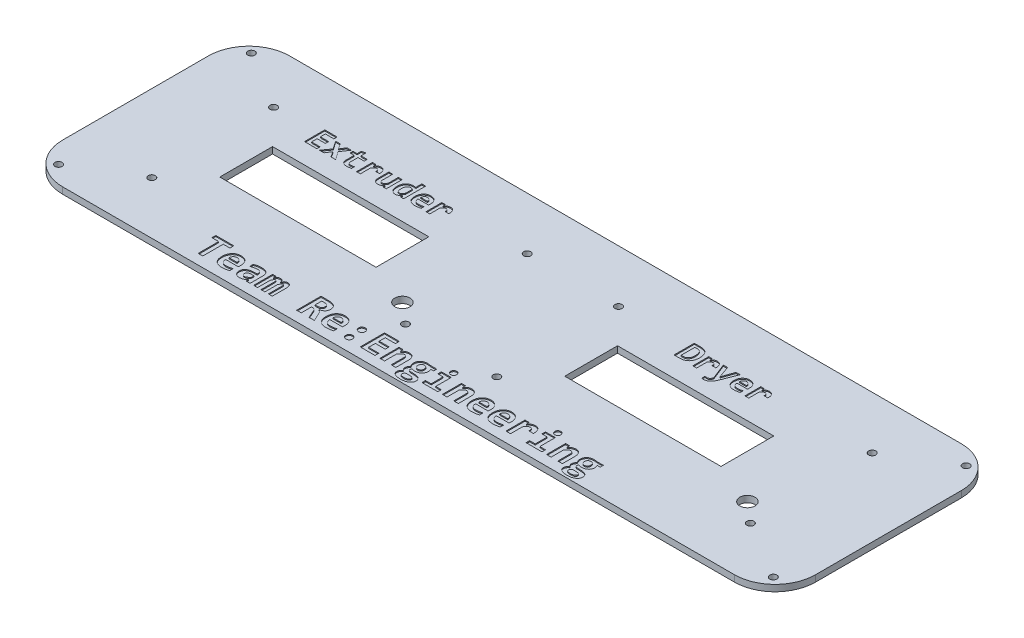
from build123d import *

# Parameters (mm, degrees)
SKETCH1_W           = 371
SKETCH1_H           = 111.8
BOSS_EXTRUDE1_DEPTH = 3.175
FILLET1_R           = 20
CUT_EXTRUDE1_REACH  = 195.766
SKETCH2_R           = 1.75
SKETCH2_W           = 77
SKETCH2_H           = 26
CUT_EXTRUDE2_REACH  = 195.766
SKETCH6_R           = 1.75
CUT_EXTRUDE3_REACH  = 195.766
SKETCH7_R           = 3.75
CUT_EXTRUDE4_DEPTH  = 0.5
CUT_EXTRUDE5_DEPTH  = 0.5


with BuildPart() as part:
    # Sketch1 → Boss-Extrude1 (new body)
    with BuildSketch(Plane(origin=(0, 0, 0), x_dir=(1, 0, 0), z_dir=(0, 1, 0))):
        Rectangle(SKETCH1_W, SKETCH1_H)
    extrude(amount=BOSS_EXTRUDE1_DEPTH)

    # Fillet1
    fillet1_edges = [part.edges().sort_by_distance(p)[0] for p in [
        (185.5, 1.5875, 55.9),
        (-185.5, 1.5875, 55.9),
        (-185.5, 1.5875, -55.9),
        (185.5, 1.5875, -55.9),
    ]]
    fillet(fillet1_edges, radius=FILLET1_R)

    # Sketch2 → Cut-Extrude1 (cut, up to next)
    with BuildSketch(Plane(origin=(0, 3.175, 0), x_dir=(1, 0, 0), z_dir=(0, 1, 0)), mode=Mode.PRIVATE) as cut_extrude1_sk1:
        with Locations(Location((-147.5, 30, 0), (0, 0, 270))):
            Circle(SKETCH2_R)
    cut_extrude1_tool1 = extrude(cut_extrude1_sk1.sketch, amount=-CUT_EXTRUDE1_REACH, mode=Mode.PRIVATE) & part.part
    # Sketch2 → Cut-Extrude1 (cut, up to next)
    with BuildSketch(Plane(origin=(0, 3.175, 0), x_dir=(1, 0, 0), z_dir=(0, 1, 0)), mode=Mode.PRIVATE) as cut_extrude1_sk2:
        with Locations(Location((-147.5, -30, 0), (0, 0, 270))):
            Circle(SKETCH2_R)
    cut_extrude1_tool2 = extrude(cut_extrude1_sk2.sketch, amount=-CUT_EXTRUDE1_REACH, mode=Mode.PRIVATE) & part.part
    # Sketch2 → Cut-Extrude1 (cut, up to next)
    with BuildSketch(Plane(origin=(0, 3.175, 0), x_dir=(1, 0, 0), z_dir=(0, 1, 0)), mode=Mode.PRIVATE) as cut_extrude1_sk3:
        with Locations(Location((-22.5, -30, 0), (0, 0, 270))):
            Circle(SKETCH2_R)
    cut_extrude1_tool3 = extrude(cut_extrude1_sk3.sketch, amount=-CUT_EXTRUDE1_REACH, mode=Mode.PRIVATE) & part.part
    # Sketch2 → Cut-Extrude1 (cut, up to next)
    with BuildSketch(Plane(origin=(0, 3.175, 0), x_dir=(1, 0, 0), z_dir=(0, 1, 0)), mode=Mode.PRIVATE) as cut_extrude1_sk4:
        with Locations(Location((-22.5, 30, 0), (0, 0, 270))):
            Circle(SKETCH2_R)
    cut_extrude1_tool4 = extrude(cut_extrude1_sk4.sketch, amount=-CUT_EXTRUDE1_REACH, mode=Mode.PRIVATE) & part.part
    # Sketch2 → Cut-Extrude1 (cut, up to next)
    with BuildSketch(Plane(origin=(0, 3.175, 0), x_dir=(1, 0, 0), z_dir=(0, 1, 0)), mode=Mode.PRIVATE) as cut_extrude1_sk5:
        with Locations(Location((147.5, 30, 0), (0, 0, 270))):
            Circle(SKETCH2_R)
    cut_extrude1_tool5 = extrude(cut_extrude1_sk5.sketch, amount=-CUT_EXTRUDE1_REACH, mode=Mode.PRIVATE) & part.part
    # Sketch2 → Cut-Extrude1 (cut, up to next)
    with BuildSketch(Plane(origin=(0, 3.175, 0), x_dir=(1, 0, 0), z_dir=(0, 1, 0)), mode=Mode.PRIVATE) as cut_extrude1_sk6:
        with Locations(Location((147.5, -30, 0), (0, 0, 270))):
            Circle(SKETCH2_R)
    cut_extrude1_tool6 = extrude(cut_extrude1_sk6.sketch, amount=-CUT_EXTRUDE1_REACH, mode=Mode.PRIVATE) & part.part
    # Sketch2 → Cut-Extrude1 (cut, up to next)
    with BuildSketch(Plane(origin=(0, 3.175, 0), x_dir=(1, 0, 0), z_dir=(0, 1, 0)), mode=Mode.PRIVATE) as cut_extrude1_sk7:
        with Locations(Location((22.5, -30, 0), (0, 0, 270))):
            Circle(SKETCH2_R)
    cut_extrude1_tool7 = extrude(cut_extrude1_sk7.sketch, amount=-CUT_EXTRUDE1_REACH, mode=Mode.PRIVATE) & part.part
    # Sketch2 → Cut-Extrude1 (cut, up to next)
    with BuildSketch(Plane(origin=(0, 3.175, 0), x_dir=(1, 0, 0), z_dir=(0, 1, 0)), mode=Mode.PRIVATE) as cut_extrude1_sk8:
        with Locations(Location((22.5, 30, 0), (0, 0, 270))):
            Circle(SKETCH2_R)
    cut_extrude1_tool8 = extrude(cut_extrude1_sk8.sketch, amount=-CUT_EXTRUDE1_REACH, mode=Mode.PRIVATE) & part.part
    # Sketch2 → Cut-Extrude1 (cut, up to next)
    with BuildSketch(Plane(origin=(0, 3.175, 0), x_dir=(1, 0, 0), z_dir=(0, 1, 0)), mode=Mode.PRIVATE) as cut_extrude1_sk9:
        with Locations((-92.5, 0)):
            Rectangle(SKETCH2_W, SKETCH2_H)
    cut_extrude1_tool9 = extrude(cut_extrude1_sk9.sketch, amount=-CUT_EXTRUDE1_REACH, mode=Mode.PRIVATE) & part.part
    # Sketch2 → Cut-Extrude1 (cut, up to next)
    with BuildSketch(Plane(origin=(0, 3.175, 0), x_dir=(1, 0, 0), z_dir=(0, 1, 0)), mode=Mode.PRIVATE) as cut_extrude1_sk10:
        with Locations((77.5, 0)):
            Rectangle(SKETCH2_W, SKETCH2_H)
    cut_extrude1_tool10 = extrude(cut_extrude1_sk10.sketch, amount=-CUT_EXTRUDE1_REACH, mode=Mode.PRIVATE) & part.part
    add(cut_extrude1_tool1.solids().sort_by_distance((-147.5, 3.175, -30))[0], mode=Mode.SUBTRACT)
    add(cut_extrude1_tool2.solids().sort_by_distance((-147.5, 3.175, 30))[0], mode=Mode.SUBTRACT)
    add(cut_extrude1_tool3.solids().sort_by_distance((-22.5, 3.175, 30))[0], mode=Mode.SUBTRACT)
    add(cut_extrude1_tool4.solids().sort_by_distance((-22.5, 3.175, -30))[0], mode=Mode.SUBTRACT)
    add(cut_extrude1_tool5.solids().sort_by_distance((147.5, 3.175, -30))[0], mode=Mode.SUBTRACT)
    add(cut_extrude1_tool6.solids().sort_by_distance((147.5, 3.175, 30))[0], mode=Mode.SUBTRACT)
    add(cut_extrude1_tool7.solids().sort_by_distance((22.5, 3.175, 30))[0], mode=Mode.SUBTRACT)
    add(cut_extrude1_tool8.solids().sort_by_distance((22.5, 3.175, -30))[0], mode=Mode.SUBTRACT)
    add(cut_extrude1_tool9.solids().sort_by_distance((-92.5, 3.175, 0))[0], mode=Mode.SUBTRACT)
    add(cut_extrude1_tool10.solids().sort_by_distance((77.5, 3.175, 0))[0], mode=Mode.SUBTRACT)

    # Sketch6 → Cut-Extrude2 (cut, up to next)
    with BuildSketch(Plane(origin=(0, 3.175, 0), x_dir=(1, 0, 0), z_dir=(0, 1, 0)), mode=Mode.PRIVATE) as cut_extrude2_sk1:
        with Locations(Location((176.106601718, 47.663795286, 0), (0, 0, 270))):
            Circle(SKETCH6_R)
    cut_extrude2_tool1 = extrude(cut_extrude2_sk1.sketch, amount=-CUT_EXTRUDE2_REACH, mode=Mode.PRIVATE) & part.part
    # Sketch6 → Cut-Extrude2 (cut, up to next)
    with BuildSketch(Plane(origin=(0, 3.175, 0), x_dir=(1, 0, 0), z_dir=(0, 1, 0)), mode=Mode.PRIVATE) as cut_extrude2_sk2:
        with Locations(Location((-176.106601718, 47.663795286, 0), (0, 0, 270))):
            Circle(SKETCH6_R)
    cut_extrude2_tool2 = extrude(cut_extrude2_sk2.sketch, amount=-CUT_EXTRUDE2_REACH, mode=Mode.PRIVATE) & part.part
    # Sketch6 → Cut-Extrude2 (cut, up to next)
    with BuildSketch(Plane(origin=(0, 3.175, 0), x_dir=(1, 0, 0), z_dir=(0, 1, 0)), mode=Mode.PRIVATE) as cut_extrude2_sk3:
        with Locations(Location((-176.106601718, -47.337186927, 0), (0, 0, 270))):
            Circle(SKETCH6_R)
    cut_extrude2_tool3 = extrude(cut_extrude2_sk3.sketch, amount=-CUT_EXTRUDE2_REACH, mode=Mode.PRIVATE) & part.part
    # Sketch6 → Cut-Extrude2 (cut, up to next)
    with BuildSketch(Plane(origin=(0, 3.175, 0), x_dir=(1, 0, 0), z_dir=(0, 1, 0)), mode=Mode.PRIVATE) as cut_extrude2_sk4:
        with Locations(Location((176.106601718, -47.337186927, 0), (0, 0, 270))):
            Circle(SKETCH6_R)
    cut_extrude2_tool4 = extrude(cut_extrude2_sk4.sketch, amount=-CUT_EXTRUDE2_REACH, mode=Mode.PRIVATE) & part.part
    add(cut_extrude2_tool1.solids().sort_by_distance((176.106602, 3.175, -47.663795))[0], mode=Mode.SUBTRACT)
    add(cut_extrude2_tool2.solids().sort_by_distance((-176.106602, 3.175, -47.663795))[0], mode=Mode.SUBTRACT)
    add(cut_extrude2_tool3.solids().sort_by_distance((-176.106602, 3.175, 47.337187))[0], mode=Mode.SUBTRACT)
    add(cut_extrude2_tool4.solids().sort_by_distance((176.106602, 3.175, 47.337187))[0], mode=Mode.SUBTRACT)

    # Sketch7 → Cut-Extrude3 (cut, up to next)
    with BuildSketch(Plane(origin=(0, 3.175, 0), x_dir=(1, 0, 0), z_dir=(0, 1, 0)), mode=Mode.PRIVATE) as cut_extrude3_sk1:
        with Locations(Location((-32.5, -21.5, 0), (0, 0, 270))):
            Circle(SKETCH7_R)
    cut_extrude3_tool1 = extrude(cut_extrude3_sk1.sketch, amount=-CUT_EXTRUDE3_REACH, mode=Mode.PRIVATE) & part.part
    # Sketch7 → Cut-Extrude3 (cut, up to next)
    with BuildSketch(Plane(origin=(0, 3.175, 0), x_dir=(1, 0, 0), z_dir=(0, 1, 0)), mode=Mode.PRIVATE) as cut_extrude3_sk2:
        with Locations(Location((137.5, -21.5, 0), (0, 0, 270))):
            Circle(SKETCH7_R)
    cut_extrude3_tool2 = extrude(cut_extrude3_sk2.sketch, amount=-CUT_EXTRUDE3_REACH, mode=Mode.PRIVATE) & part.part
    add(cut_extrude3_tool1.solids().sort_by_distance((-32.5, 3.175, 21.5))[0], mode=Mode.SUBTRACT)
    add(cut_extrude3_tool2.solids().sort_by_distance((137.5, 3.175, 21.5))[0], mode=Mode.SUBTRACT)

    # Sketch11 → Cut-Extrude4 (cut)
    # profile 1 of 13: a face of its own
    with BuildSketch(Plane(origin=(0, 3.175, 0), x_dir=(1, 0, 0), z_dir=(0, 1, 0))):
        with BuildLine():
            add(Edge.make_bspline(
                [(-60.760869565, 27.782608696), (-60.759712941, 27.851292409), (-60.757501131, 27.982636109), (-60.760672943, 28.172426416), (-60.776371941, 28.345696356), (-60.809065079, 28.54863876), (-60.863398576, 28.772927744), (-60.972235375, 28.999112726), (-61.112789264, 29.176230142), (-61.289421636, 29.294067873), (-61.49155108, 29.365489382), (-61.635104003, 29.372940237), (-61.709692029, 29.376811594)],
                knots=[0, 0, 0, 0, 0.976776958, 1.86788822, 2.697749972, 3.447690252, 4.791052046, 5.96229558, 6.991616706, 7.96508575, 8.942687937, 10, 10, 10, 10], degree=3))
            add(Edge.make_bspline(
                [(-61.709692029, 29.376811594), (-61.778822441, 29.372795185), (-61.921377011, 29.364512904), (-62.1346249, 29.296443252), (-62.348759861, 29.186782753), (-62.569923846, 29.037776464), (-62.792203585, 28.834269687), (-63.028853285, 28.584698611), (-63.272052905, 28.276605264), (-63.430495852, 28.048476405), (-63.514492754, 27.927536232)],
                knots=[0, 0, 0, 0, 0.690160971, 1.42318841, 2.216380134, 3.091386283, 4.08043663, 5.222959024, 6.527780232, 8, 8, 8, 8], degree=3))
            Line((-63.514492754, 27.927536232), (-63.514492754, 23))
            Line((-63.514492754, 23), (-65.398550725, 23))
            Line((-65.398550725, 23), (-65.398550725, 30.826086957))
            Line((-65.398550725, 30.826086957), (-63.734148551, 30.826086957))
            Line((-63.734148551, 30.826086957), (-63.666213768, 29.666666667))
            add(Edge.make_bspline(
                [(-63.666213768, 29.666666667), (-63.600267863, 29.762529766), (-63.470038355, 29.951839537), (-63.241439092, 30.20747545), (-62.986677551, 30.431440248), (-62.70262772, 30.620560415), (-62.390811697, 30.77775036), (-62.043711959, 30.886825116), (-61.665207998, 30.960266114), (-61.400585973, 30.967348058), (-61.263586957, 30.971014493)],
                knots=[0, 0, 0, 0, 0.974824238, 1.925076027, 2.866944946, 3.811298368, 4.779277887, 5.783987857, 6.852735393, 8, 8, 8, 8], degree=3))
            add(Edge.make_bspline(
                [(-61.263586957, 30.971014493), (-61.168396356, 30.968059273), (-60.983345057, 30.962314303), (-60.71308176, 30.927691476), (-60.461174884, 30.859961441), (-60.22398116, 30.773051006), (-60.004515475, 30.658227443), (-59.80275314, 30.520277516), (-59.61845585, 30.357496034), (-59.456222525, 30.167934156), (-59.309737074, 29.956219465), (-59.184733334, 29.718170609), (-59.081335183, 29.454404353), (-58.997863566, 29.165499194), (-58.935431543, 28.85258569), (-58.892395212, 28.516693796), (-58.872503797, 28.157242168), (-58.875344574, 27.910190108), (-58.876811594, 27.782608696)],
                knots=[0, 0, 0, 0, 1.004676022, 1.953098346, 2.866842467, 3.75148626, 4.613577702, 5.472942283, 6.324856067, 7.199983409, 8.099136356, 9.036153176, 10.030037521, 11.083594088, 12.205103978, 13.393537797, 14.653983583, 16, 16, 16, 16], degree=3))
            Line((-58.876811594, 27.782608696), (-60.760869565, 27.782608696))
        make_face()
    # profile 2 of 13: a face of its own
    with BuildSketch(Plane(origin=(0, 3.175, 0), x_dir=(1, 0, 0), z_dir=(0, 1, 0))):
        with BuildLine():
            add(Edge.make_bspline(
                [(-67.572463768, 27.540307971), (-67.572851767, 27.467835553), (-67.573733084, 27.30321828), (-67.584206794, 27.040575919), (-67.59432069, 26.758665773), (-67.611652713, 26.569542382), (-67.620018116, 26.47826087)],
                knots=[0, 0, 0, 0, 0.817723831, 1.857416531, 2.965869532, 4, 4, 4, 4], degree=3))
            Line((-67.620018116, 26.47826087), (-72.789855072, 26.47826087))
            add(Edge.make_bspline(
                [(-72.789855072, 26.47826087), (-72.78874283, 26.392070245), (-72.786578392, 26.224342053), (-72.751778215, 25.981727451), (-72.70719951, 25.75317217), (-72.636207479, 25.542419064), (-72.546515455, 25.348290613), (-72.443482149, 25.16891117), (-72.322083957, 25.006710186), (-72.185346733, 24.860989806), (-72.033441766, 24.730615729), (-71.863605207, 24.620698341), (-71.682950723, 24.521766624), (-71.486315604, 24.443608186), (-71.278524729, 24.378838115), (-71.057964545, 24.338131937), (-70.827318796, 24.308902817), (-70.669635475, 24.305891943), (-70.588768116, 24.304347826)],
                knots=[0, 0, 0, 0, 1.179290589, 2.294916396, 3.351295625, 4.364764696, 5.331602319, 6.276694144, 7.192669172, 8.099614974, 9.009032183, 9.926581103, 10.865546218, 11.825449834, 12.819647447, 13.841518478, 14.893030041, 16, 16, 16, 16], degree=3))
            add(Edge.make_bspline(
                [(-70.588768116, 24.304347826), (-70.390780744, 24.309330831), (-69.980586684, 24.319654717), (-69.462060336, 24.38722117), (-69.030118554, 24.463112291), (-68.69368302, 24.537981074), (-68.352092962, 24.631699245), (-68.123287132, 24.702979877), (-68.007246377, 24.739130435)],
                knots=[0, 0, 0, 0, 1.355541314, 2.808436665, 3.575023574, 4.358862549, 5.167683667, 6, 6, 6, 6], degree=3))
            Line((-68.007246377, 24.739130435), (-68.007246377, 23.289855072))
            add(Edge.make_bspline(
                [(-68.007246377, 23.289855072), (-68.111170281, 23.258793439), (-68.327543511, 23.194122023), (-68.665376789, 23.111978685), (-69.021099846, 23.041926014), (-69.385294246, 22.974982826), (-69.755915423, 22.919956567), (-70.128467396, 22.88253245), (-70.497117777, 22.858650843), (-70.740453976, 22.856254656), (-70.860507246, 22.855072464)],
                knots=[0, 0, 0, 0, 0.898776519, 1.871284374, 2.879703842, 3.90303, 4.9398418, 5.983668506, 7.005215048, 8, 8, 8, 8], degree=3))
            add(Edge.make_bspline(
                [(-70.860507246, 22.855072464), (-71.005591753, 22.857842642), (-71.288274693, 22.863240064), (-71.7007312, 22.913200815), (-72.091139017, 22.987334788), (-72.457387819, 23.099150269), (-72.798220743, 23.241547304), (-73.113158583, 23.414861874), (-73.402310251, 23.616832223), (-73.664432488, 23.848696205), (-73.897502035, 24.112007931), (-74.101083588, 24.405003965), (-74.276477766, 24.726879541), (-74.421776111, 25.077404879), (-74.53429948, 25.457049242), (-74.615013726, 25.86484105), (-74.666152712, 26.301085802), (-74.671275417, 26.601904904), (-74.673913043, 26.756793478)],
                knots=[0, 0, 0, 0, 1.121620277, 2.185367166, 3.208914926, 4.191382306, 5.14116652, 6.060889567, 6.966233761, 7.863618855, 8.76100395, 9.679262128, 10.617148408, 11.590729859, 12.60841723, 13.674324534, 14.802534302, 16, 16, 16, 16], degree=3))
            add(Edge.make_bspline(
                [(-74.673913043, 26.756793478), (-74.67121934, 26.911678699), (-74.66594858, 27.21474208), (-74.614482676, 27.65767326), (-74.533406215, 28.078776505), (-74.42125277, 28.477914559), (-74.275180898, 28.852296686), (-74.104526062, 29.200895052), (-73.905561805, 29.522276519), (-73.678809712, 29.813832657), (-73.427905021, 30.079518348), (-73.14607899, 30.307412884), (-72.844124591, 30.510322728), (-72.513389787, 30.673782612), (-72.162471456, 30.809348616), (-71.789140278, 30.903187957), (-71.396794584, 30.961760418), (-71.128685363, 30.967887403), (-70.991847826, 30.971014493)],
                knots=[0, 0, 0, 0, 1.180034156, 2.308968792, 3.393220884, 4.44579929, 5.46393457, 6.451895544, 7.400149152, 8.339143413, 9.262785816, 10.178384736, 11.095843329, 12.029766064, 12.983882541, 13.957808115, 14.957706464, 16, 16, 16, 16], degree=3))
            add(Edge.make_bspline(
                [(-70.991847826, 30.971014493), (-70.85735763, 30.968055772), (-70.595043837, 30.962284992), (-70.213298441, 30.915001989), (-69.856455645, 30.832961174), (-69.523040183, 30.722257021), (-69.21609055, 30.581181999), (-68.931842302, 30.418796107), (-68.67683292, 30.226489434), (-68.447301783, 30.010359159), (-68.242225284, 29.771826214), (-68.064523297, 29.509670068), (-67.915585276, 29.224773642), (-67.790654219, 28.920969846), (-67.693622494, 28.598499148), (-67.62403287, 28.259768781), (-67.579263721, 27.905333498), (-67.574758356, 27.663482798), (-67.572463768, 27.540307971)],
                knots=[0, 0, 0, 0, 1.178593255, 2.298764342, 3.364464973, 4.383380692, 5.372275211, 6.320955639, 7.247223129, 8.164610705, 9.079585451, 9.998951109, 10.93417802, 11.892522129, 12.874152535, 13.88107589, 14.920829619, 16, 16, 16, 16], degree=3))
        make_face()
        with BuildLine():
            add(Edge.make_bspline(
                [(-69.456521739, 27.782608696), (-69.456863002, 27.854359034), (-69.45752196, 27.992904732), (-69.477515973, 28.194010757), (-69.516111789, 28.380545134), (-69.570670094, 28.553276285), (-69.638222619, 28.711837596), (-69.718247397, 28.855788914), (-69.808266238, 28.985774474), (-69.911416144, 29.099345587), (-70.023691039, 29.20030724), (-70.144824219, 29.288169132), (-70.275713411, 29.361551523), (-70.461827119, 29.439811817), (-70.713120418, 29.50936721), (-70.92187403, 29.517567264), (-71.02807971, 29.52173913)],
                knots=[0, 0, 0, 0, 1.134846417, 2.191321935, 3.191481249, 4.143340004, 5.052899811, 5.913632381, 6.745287675, 7.548677924, 8.335201916, 9.130741839, 9.911440996, 10.703386864, 12.32281206, 14, 14, 14, 14], degree=3))
            add(Edge.make_bspline(
                [(-71.02807971, 29.52173913), (-71.087054547, 29.520776546), (-71.202446715, 29.518893122), (-71.370272972, 29.494165351), (-71.530768854, 29.461598557), (-71.683503699, 29.411412185), (-71.827406207, 29.344998994), (-71.96552819, 29.268682776), (-72.092337312, 29.17394211), (-72.253622006, 29.032028247), (-72.430308363, 28.818812323), (-72.588533753, 28.513864292), (-72.707362866, 28.165936513), (-72.740722747, 27.914155756), (-72.758152174, 27.782608696)],
                knots=[0, 0, 0, 0, 0.778791991, 1.523810857, 2.23806509, 2.941647734, 3.642679102, 4.330739894, 5.023199128, 5.729957914, 7.168361981, 8.650260572, 10.249872714, 12, 12, 12, 12], degree=3))
            Line((-72.758152174, 27.782608696), (-69.456521739, 27.782608696))
        make_face(mode=Mode.SUBTRACT)
    # profile 3 of 13: a face of its own
    with BuildSketch(Plane(origin=(0, 3.175, 0), x_dir=(1, 0, 0), z_dir=(0, 1, 0))):
        with BuildLine():
            Line((-78.043478261, 23), (-78.088768116, 24.154891304))
            add(Edge.make_bspline(
                [(-78.088768116, 24.154891304), (-78.170136343, 24.061243254), (-78.330275209, 23.876936761), (-78.58191698, 23.618997049), (-78.851474936, 23.394043712), (-79.139440519, 23.204767942), (-79.449302106, 23.053918497), (-79.780668818, 22.938928488), (-80.142524922, 22.865811852), (-80.394410342, 22.85874594), (-80.525362319, 22.855072464)],
                knots=[0, 0, 0, 0, 1.038921603, 2.044676821, 3.014322331, 3.973401101, 4.923332122, 5.892915811, 6.904554136, 8, 8, 8, 8], degree=3))
            add(Edge.make_bspline(
                [(-80.525362319, 22.855072464), (-80.635783584, 22.858545472), (-80.851856811, 22.865341483), (-81.166556291, 22.918777822), (-81.463298596, 23.004595159), (-81.740379314, 23.124741497), (-81.996839225, 23.27790967), (-82.2301445, 23.463154047), (-82.445241827, 23.674422782), (-82.635849829, 23.917393773), (-82.805970015, 24.187484035), (-82.952756344, 24.486405002), (-83.079407172, 24.811536482), (-83.185384909, 25.162801547), (-83.268960719, 25.538183724), (-83.326275593, 25.935645558), (-83.364177936, 26.35373207), (-83.367740082, 26.639707043), (-83.369565217, 26.786231884)],
                knots=[0, 0, 0, 0, 0.970024179, 1.898151179, 2.796667003, 3.679095344, 4.544908702, 5.414197047, 6.291423112, 7.188664514, 8.121827946, 9.091988227, 10.110806321, 11.185317569, 12.31359368, 13.487295601, 14.712567012, 16, 16, 16, 16], degree=3))
            add(Edge.make_bspline(
                [(-83.369565217, 26.786231884), (-83.366620939, 26.960028614), (-83.360932946, 27.295783119), (-83.302255345, 27.781212117), (-83.212552895, 28.231001009), (-83.079291254, 28.644650779), (-82.914341493, 29.022704239), (-82.720691977, 29.36833382), (-82.498603508, 29.680795246), (-82.24566297, 29.957543371), (-81.967931562, 30.202874556), (-81.662127732, 30.410359591), (-81.334994725, 30.589684046), (-80.981170342, 30.728955032), (-80.608336884, 30.835788873), (-80.218813876, 30.916893367), (-79.813087882, 30.961322621), (-79.537388627, 30.967754411), (-79.397644928, 30.971014493)],
                knots=[0, 0, 0, 0, 1.272829735, 2.458954884, 3.577264154, 4.628460523, 5.636474756, 6.594834723, 7.526441315, 8.438671186, 9.336162168, 10.23513451, 11.140886529, 12.064181812, 13.014577142, 13.979933459, 14.976088737, 16, 16, 16, 16], degree=3))
            add(Edge.make_bspline(
                [(-79.397644928, 30.971014493), (-79.300930949, 30.969534716), (-79.106301531, 30.966556781), (-78.820144271, 30.934485951), (-78.548550396, 30.896031686), (-78.377599416, 30.853097451), (-78.297101449, 30.832880435)],
                knots=[0, 0, 0, 0, 1.043133863, 2.099226407, 3.104957401, 4, 4, 4, 4], degree=3))
            Line((-78.297101449, 30.832880435), (-78.297101449, 33.869565217))
            Line((-78.297101449, 33.869565217), (-76.413043478, 33.869565217))
            Line((-76.413043478, 33.869565217), (-76.413043478, 23))
            Line((-76.413043478, 23), (-78.043478261, 23))
        make_face()
        with BuildLine():
            add(Edge.make_bspline(
                [(-81.34057971, 26.876811594), (-81.339920824, 26.772626979), (-81.338649948, 26.571673125), (-81.323126699, 26.282223612), (-81.295574025, 26.016376274), (-81.26064304, 25.773390833), (-81.213173962, 25.552404394), (-81.154984153, 25.353219969), (-81.086121293, 25.174852384), (-81.011288966, 25.015279714), (-80.921067119, 24.878188983), (-80.824345326, 24.759149954), (-80.717001528, 24.660427009), (-80.599377157, 24.581589772), (-80.47173111, 24.523875612), (-80.336866564, 24.479445153), (-80.19261787, 24.454823346), (-80.093686131, 24.451154234), (-80.043025362, 24.449275362)],
                knots=[0, 0, 0, 0, 1.619841946, 3.124391088, 4.504794863, 5.774589998, 6.939429433, 8.016400399, 8.997244682, 9.910602358, 10.75049802, 11.542446217, 12.290105916, 13.009502791, 13.734146282, 14.461635616, 15.21223742, 16, 16, 16, 16], degree=3))
            add(Edge.make_bspline(
                [(-80.043025362, 24.449275362), (-79.96694394, 24.454214834), (-79.813617315, 24.464169333), (-79.589224184, 24.542438909), (-79.371618845, 24.664195808), (-79.162707341, 24.837062511), (-78.955368466, 25.051452422), (-78.739210616, 25.299447821), (-78.516649146, 25.583953756), (-78.372397535, 25.789168675), (-78.297101449, 25.896286232)],
                knots=[0, 0, 0, 0, 0.774845215, 1.561542853, 2.399398161, 3.308755612, 4.316304941, 5.440796238, 6.664153379, 8, 8, 8, 8], degree=3))
            Line((-78.297101449, 25.896286232), (-78.297101449, 29.329257246))
            add(Edge.make_bspline(
                [(-78.297101449, 29.329257246), (-78.375862884, 29.356711153), (-78.547978812, 29.416705676), (-78.830611547, 29.470884714), (-79.137449794, 29.514397732), (-79.348413168, 29.519286399), (-79.454257246, 29.52173913)],
                knots=[0, 0, 0, 0, 0.848195555, 1.85354628, 2.923085977, 4, 4, 4, 4], degree=3))
            add(Edge.make_bspline(
                [(-79.454257246, 29.52173913), (-79.525349684, 29.519672975), (-79.663861377, 29.515647417), (-79.866451625, 29.480915535), (-80.057383215, 29.421905003), (-80.237070203, 29.339371026), (-80.405787532, 29.237693095), (-80.560014865, 29.113408454), (-80.704284492, 28.972894355), (-80.832883663, 28.810808329), (-80.949427827, 28.630565202), (-81.05068584, 28.430552356), (-81.138643643, 28.212233874), (-81.214337279, 27.976569387), (-81.269188594, 27.723036364), (-81.310030313, 27.45456875), (-81.335199385, 27.170915011), (-81.33875599, 26.976501141), (-81.34057971, 26.876811594)],
                knots=[0, 0, 0, 0, 0.936472925, 1.824560452, 2.699342334, 3.563022836, 4.42463821, 5.288490582, 6.16784261, 7.07364012, 8.0091085, 8.992392364, 10.023242028, 11.108713858, 12.250356695, 13.437849017, 14.686206534, 16, 16, 16, 16], degree=3))
        make_face(mode=Mode.SUBTRACT)
    # profile 4 of 13: a face of its own
    with BuildSketch(Plane(origin=(0, 3.175, 0), x_dir=(1, 0, 0), z_dir=(0, 1, 0))):
        with BuildLine():
            Line((-89.601449275, 30.826086957), (-89.601449275, 25.740036232))
            add(Edge.make_bspline(
                [(-89.601449275, 25.740036232), (-89.598310449, 25.640269731), (-89.592403856, 25.452530755), (-89.551781983, 25.188683158), (-89.476783463, 24.963952287), (-89.376103809, 24.774212715), (-89.238573232, 24.626687366), (-89.069304388, 24.521410007), (-88.868896446, 24.459367328), (-88.725543831, 24.452747265), (-88.650362319, 24.449275362)],
                knots=[0, 0, 0, 0, 1.31270137, 2.470220042, 3.497129097, 4.417319378, 5.2744763, 6.117655166, 7.012801186, 8, 8, 8, 8], degree=3))
            add(Edge.make_bspline(
                [(-88.650362319, 24.449275362), (-88.572764768, 24.454180125), (-88.416471534, 24.464059062), (-88.187237197, 24.542924601), (-87.962455283, 24.663545438), (-87.748021347, 24.8398326), (-87.531366046, 25.052941979), (-87.306148605, 25.298095981), (-87.076963806, 25.579400789), (-86.926356504, 25.780240773), (-86.847826087, 25.884963768)],
                knots=[0, 0, 0, 0, 0.779254789, 1.569537317, 2.415803147, 3.33516661, 4.350409456, 5.47398431, 6.682872188, 8, 8, 8, 8], degree=3))
            Line((-86.847826087, 25.884963768), (-86.847826087, 30.826086957))
            Line((-86.847826087, 30.826086957), (-84.963768116, 30.826086957))
            Line((-84.963768116, 30.826086957), (-84.963768116, 23))
            Line((-84.963768116, 23), (-86.596467391, 23))
            Line((-86.596467391, 23), (-86.641757246, 24.154891304))
            add(Edge.make_bspline(
                [(-86.641757246, 24.154891304), (-86.723211915, 24.061322765), (-86.883172796, 23.877572635), (-87.132380131, 23.61968935), (-87.397585083, 23.394261994), (-87.682349562, 23.203067949), (-87.994606093, 23.053217829), (-88.332911698, 22.938321146), (-88.704698596, 22.865952565), (-88.964027335, 22.858791944), (-89.098731884, 22.855072464)],
                knots=[0, 0, 0, 0, 1.030992754, 2.024666126, 2.977293315, 3.918575094, 4.866896227, 5.846891158, 6.88159887, 8, 8, 8, 8], degree=3))
            add(Edge.make_bspline(
                [(-89.098731884, 22.855072464), (-89.194768114, 22.856637544), (-89.382382349, 22.85969505), (-89.653253676, 22.90106195), (-89.908030394, 22.957068285), (-90.14209626, 23.044880333), (-90.358134766, 23.153007682), (-90.554785116, 23.284275251), (-90.73469709, 23.433159931), (-90.893744366, 23.604213408), (-91.032845126, 23.795026819), (-91.154993187, 24.002527917), (-91.25718953, 24.229072819), (-91.340258632, 24.471856409), (-91.406812034, 24.730654195), (-91.449586494, 25.005283513), (-91.481530455, 25.293943587), (-91.484160227, 25.491600532), (-91.485507246, 25.592844203)],
                knots=[0, 0, 0, 0, 1.116811866, 2.181778732, 3.18353378, 4.148223296, 5.083490636, 5.990084579, 6.894632225, 7.796101715, 8.701204023, 9.638574155, 10.594136258, 11.5889691, 12.622589212, 13.700240707, 14.822019272, 16, 16, 16, 16], degree=3))
            Line((-91.485507246, 25.592844203), (-91.485507246, 30.826086957))
            Line((-91.485507246, 30.826086957), (-89.601449275, 30.826086957))
        make_face()
    # profile 5 of 13: a face of its own
    with BuildSketch(Plane(origin=(0, 3.175, 0), x_dir=(1, 0, 0), z_dir=(0, 1, 0))):
        with BuildLine():
            add(Edge.make_bspline(
                [(-94.963768116, 27.782608696), (-94.962611492, 27.851292409), (-94.960399682, 27.982636109), (-94.963571494, 28.172426416), (-94.979270492, 28.345696356), (-95.01196363, 28.54863876), (-95.066297127, 28.772927744), (-95.175133926, 28.999112726), (-95.315687814, 29.176230142), (-95.492320187, 29.294067873), (-95.694449631, 29.365489382), (-95.838002554, 29.372940237), (-95.91259058, 29.376811594)],
                knots=[0, 0, 0, 0, 0.976776958, 1.86788822, 2.697749972, 3.447690252, 4.791052046, 5.96229558, 6.991616706, 7.96508575, 8.942687937, 10, 10, 10, 10], degree=3))
            add(Edge.make_bspline(
                [(-95.91259058, 29.376811594), (-95.981720992, 29.372795185), (-96.124275562, 29.364512904), (-96.33752345, 29.296443252), (-96.551658411, 29.186782753), (-96.772822397, 29.037776464), (-96.995102136, 28.834269687), (-97.231751835, 28.584698611), (-97.474951456, 28.276605264), (-97.633394403, 28.048476405), (-97.717391304, 27.927536232)],
                knots=[0, 0, 0, 0, 0.690160971, 1.42318841, 2.216380134, 3.091386283, 4.08043663, 5.222959024, 6.527780232, 8, 8, 8, 8], degree=3))
            Line((-97.717391304, 27.927536232), (-97.717391304, 23))
            Line((-97.717391304, 23), (-99.601449275, 23))
            Line((-99.601449275, 23), (-99.601449275, 30.826086957))
            Line((-99.601449275, 30.826086957), (-97.937047101, 30.826086957))
            Line((-97.937047101, 30.826086957), (-97.869112319, 29.666666667))
            add(Edge.make_bspline(
                [(-97.869112319, 29.666666667), (-97.803166414, 29.762529766), (-97.672936906, 29.951839537), (-97.444337642, 30.20747545), (-97.189576102, 30.431440248), (-96.905526271, 30.620560415), (-96.593710247, 30.77775036), (-96.24661051, 30.886825116), (-95.868106549, 30.960266114), (-95.603484524, 30.967348058), (-95.466485507, 30.971014493)],
                knots=[0, 0, 0, 0, 0.974824238, 1.925076027, 2.866944946, 3.811298368, 4.779277887, 5.783987857, 6.852735393, 8, 8, 8, 8], degree=3))
            add(Edge.make_bspline(
                [(-95.466485507, 30.971014493), (-95.371294907, 30.968059273), (-95.186243608, 30.962314303), (-94.915980311, 30.927691476), (-94.664073434, 30.859961441), (-94.426879711, 30.773051006), (-94.207414026, 30.658227443), (-94.00565169, 30.520277516), (-93.821354401, 30.357496034), (-93.659121076, 30.167934156), (-93.512635625, 29.956219465), (-93.387631885, 29.718170609), (-93.284233734, 29.454404353), (-93.200762116, 29.165499194), (-93.138330094, 28.85258569), (-93.095293762, 28.516693796), (-93.075402348, 28.157242168), (-93.078243125, 27.910190108), (-93.079710145, 27.782608696)],
                knots=[0, 0, 0, 0, 1.004676022, 1.953098346, 2.866842467, 3.75148626, 4.613577702, 5.472942283, 6.324856067, 7.199983409, 8.099136356, 9.036153176, 10.030037521, 11.083594088, 12.205103978, 13.393537797, 14.653983583, 16, 16, 16, 16], degree=3))
            Line((-93.079710145, 27.782608696), (-94.963768116, 27.782608696))
        make_face()
    # profile 6 of 13: a face of its own
    with BuildSketch(Plane(origin=(0, 3.175, 0), x_dir=(1, 0, 0), z_dir=(0, 1, 0))):
        with BuildLine():
            add(Edge.make_bspline(
                [(-102.210144928, 23.144927536), (-102.378872308, 23.104031081), (-102.715408821, 23.022460738), (-103.220769353, 22.93061195), (-103.714511274, 22.868262892), (-104.038929887, 22.859377353), (-104.196105072, 22.855072464)],
                knots=[0, 0, 0, 0, 1.035388674, 2.065142565, 3.062595162, 4, 4, 4, 4], degree=3))
            add(Edge.make_bspline(
                [(-104.196105072, 22.855072464), (-104.319230625, 22.856240886), (-104.557623929, 22.858503163), (-104.901598972, 22.891941473), (-105.219875674, 22.939737642), (-105.511575025, 23.01017785), (-105.778759711, 23.099551918), (-106.020418887, 23.21406033), (-106.239367089, 23.347197963), (-106.434300811, 23.50302674), (-106.605917986, 23.680397213), (-106.75068469, 23.882099596), (-106.87536735, 24.103776535), (-106.97146064, 24.350492713), (-107.046135264, 24.620743082), (-107.099559937, 24.914000261), (-107.131269475, 25.232095738), (-107.135488891, 25.451615244), (-107.137681159, 25.56567029)],
                knots=[0, 0, 0, 0, 1.278009303, 2.474456794, 3.585269373, 4.617562023, 5.586743763, 6.505384762, 7.388599368, 8.241810538, 9.08996624, 9.942853317, 10.813033416, 11.724186965, 12.684580936, 13.720764504, 14.815784914, 16, 16, 16, 16], degree=3))
            Line((-107.137681159, 25.56567029), (-107.137681159, 29.376811594))
            Line((-107.137681159, 29.376811594), (-109.166666667, 29.376811594))
            Line((-109.166666667, 29.376811594), (-109.166666667, 30.826086957))
            Line((-109.166666667, 30.826086957), (-107.137681159, 30.826086957))
            Line((-107.137681159, 30.826086957), (-107.137681159, 32.796195652))
            Line((-107.137681159, 32.796195652), (-105.253623188, 33.289855072))
            Line((-105.253623188, 33.289855072), (-105.253623188, 30.826086957))
            Line((-105.253623188, 30.826086957), (-102.210144928, 30.826086957))
            Line((-102.210144928, 30.826086957), (-102.210144928, 29.376811594))
            Line((-102.210144928, 29.376811594), (-105.253623188, 29.376811594))
            Line((-105.253623188, 29.376811594), (-105.253623188, 25.669836957))
            add(Edge.make_bspline(
                [(-105.253623188, 25.669836957), (-105.249694151, 25.563939843), (-105.242277289, 25.364037408), (-105.188206649, 25.083237134), (-105.088917228, 24.844528283), (-104.97600497, 24.675040161), (-104.863809809, 24.563587922), (-104.763341369, 24.497161891), (-104.655543131, 24.433466295), (-104.530726987, 24.388052728), (-104.395071578, 24.347629011), (-104.244805942, 24.326246166), (-104.083459316, 24.305052184), (-103.971253563, 24.304588418), (-103.913043478, 24.304347826)],
                knots=[0, 0, 0, 0, 1.725666033, 3.257547169, 4.630505426, 5.913390447, 6.548402219, 7.193344041, 7.870781762, 8.583485179, 9.350585459, 10.173636403, 11.052519361, 12, 12, 12, 12], degree=3))
            add(Edge.make_bspline(
                [(-103.913043478, 24.304347826), (-103.760291665, 24.308576353), (-103.45789491, 24.316947403), (-103.016270463, 24.386925197), (-102.601394903, 24.48070126), (-102.336638236, 24.557507183), (-102.210144928, 24.594202899)],
                knots=[0, 0, 0, 0, 1.056791564, 2.092088674, 3.088453494, 4, 4, 4, 4], degree=3))
            Line((-102.210144928, 24.594202899), (-102.210144928, 23.144927536))
        make_face()
    # profile 7 of 13: a face of its own
    with BuildSketch(Plane(origin=(0, 3.175, 0), x_dir=(1, 0, 0), z_dir=(0, 1, 0))):
        Polygon((-112.207880435, 23), (-113.876811594, 25.706068841), (-115.679347826, 23), (-117.934782609, 23), (-115.06567029, 26.944746377), (-117.717391304, 30.826086957), (-115.448369565, 30.826086957), (-113.804347826, 28.217391304), (-112.130887681, 30.826086957), (-110.036231884, 30.826086957), (-112.674365942, 26.958333333), (-109.891304348, 23), align=None)
    # profile 8 of 13: a face of its own
    with BuildSketch(Plane(origin=(0, 3.175, 0), x_dir=(1, 0, 0), z_dir=(0, 1, 0))):
        Polygon((-125.253623188, 23), (-125.253623188, 33), (-119.166666667, 33), (-119.166666667, 31.405797101), (-123.369565217, 31.405797101), (-123.369565217, 28.942028986), (-119.311594203, 28.942028986), (-119.311594203, 27.347826087), (-123.369565217, 27.347826087), (-123.369565217, 24.594202899), (-119.166666667, 24.594202899), (-119.166666667, 23), align=None)
    # profile 9 of 13: a face of its own
    with BuildSketch(Plane(origin=(0, 3.175, 0), x_dir=(1, 0, 0), z_dir=(0, 1, 0))):
        with BuildLine():
            add(Edge.make_bspline(
                [(96.413043478, 27.782608696), (96.414200103, 27.851292409), (96.416411912, 27.982636109), (96.4132401, 28.172426416), (96.397541102, 28.345696356), (96.364847964, 28.54863876), (96.310514468, 28.772927744), (96.201677669, 28.999112726), (96.06112378, 29.176230142), (95.884491407, 29.294067873), (95.682361963, 29.365489382), (95.53880904, 29.372940237), (95.464221014, 29.376811594)],
                knots=[0, 0, 0, 0, 0.976776958, 1.86788822, 2.697749972, 3.447690252, 4.791052046, 5.96229558, 6.991616706, 7.96508575, 8.942687937, 10, 10, 10, 10], degree=3))
            add(Edge.make_bspline(
                [(95.464221014, 29.376811594), (95.395090603, 29.372795185), (95.252536032, 29.364512904), (95.039288144, 29.296443252), (94.825153183, 29.186782753), (94.603989197, 29.037776464), (94.381709458, 28.834269687), (94.145059759, 28.584698611), (93.901860138, 28.276605264), (93.743417192, 28.048476405), (93.65942029, 27.927536232)],
                knots=[0, 0, 0, 0, 0.690160971, 1.42318841, 2.216380134, 3.091386283, 4.08043663, 5.222959024, 6.527780232, 8, 8, 8, 8], degree=3))
            Line((93.65942029, 27.927536232), (93.65942029, 23))
            Line((93.65942029, 23), (91.775362319, 23))
            Line((91.775362319, 23), (91.775362319, 30.826086957))
            Line((91.775362319, 30.826086957), (93.439764493, 30.826086957))
            Line((93.439764493, 30.826086957), (93.507699275, 29.666666667))
            add(Edge.make_bspline(
                [(93.507699275, 29.666666667), (93.57364518, 29.762529766), (93.703874688, 29.951839537), (93.932473952, 30.20747545), (94.187235492, 30.431440248), (94.471285323, 30.620560415), (94.783101347, 30.77775036), (95.130201084, 30.886825116), (95.508705045, 30.960266114), (95.773327071, 30.967348058), (95.910326087, 30.971014493)],
                knots=[0, 0, 0, 0, 0.974824238, 1.925076027, 2.866944946, 3.811298368, 4.779277887, 5.783987857, 6.852735393, 8, 8, 8, 8], degree=3))
            add(Edge.make_bspline(
                [(95.910326087, 30.971014493), (96.005516687, 30.968059273), (96.190567987, 30.962314303), (96.460831283, 30.927691476), (96.71273816, 30.859961441), (96.949931883, 30.773051006), (97.169397568, 30.658227443), (97.371159904, 30.520277516), (97.555457194, 30.357496034), (97.717690518, 30.167934156), (97.864175969, 29.956219465), (97.98917971, 29.718170609), (98.09257786, 29.454404353), (98.176049478, 29.165499194), (98.2384815, 28.85258569), (98.281517832, 28.516693796), (98.301409246, 28.157242168), (98.298568469, 27.910190108), (98.297101449, 27.782608696)],
                knots=[0, 0, 0, 0, 1.004676022, 1.953098346, 2.866842467, 3.75148626, 4.613577702, 5.472942283, 6.324856067, 7.199983409, 8.099136356, 9.036153176, 10.030037521, 11.083594088, 12.205103978, 13.393537797, 14.653983583, 16, 16, 16, 16], degree=3))
            Line((98.297101449, 27.782608696), (96.413043478, 27.782608696))
        make_face()
    # profile 10 of 13: a face of its own
    with BuildSketch(Plane(origin=(0, 3.175, 0), x_dir=(1, 0, 0), z_dir=(0, 1, 0))):
        with BuildLine():
            add(Edge.make_bspline(
                [(89.601449275, 27.540307971), (89.601061277, 27.467835553), (89.600179959, 27.30321828), (89.589706249, 27.040575919), (89.579592354, 26.758665773), (89.56226033, 26.569542382), (89.553894928, 26.47826087)],
                knots=[0, 0, 0, 0, 0.817723831, 1.857416531, 2.965869532, 4, 4, 4, 4], degree=3))
            Line((89.553894928, 26.47826087), (84.384057971, 26.47826087))
            add(Edge.make_bspline(
                [(84.384057971, 26.47826087), (84.385170213, 26.392070245), (84.387334652, 26.224342053), (84.422134828, 25.981727451), (84.466713533, 25.75317217), (84.537705565, 25.542419064), (84.627397589, 25.348290613), (84.730430895, 25.16891117), (84.851829087, 25.006710186), (84.98856631, 24.860989806), (85.140471278, 24.730615729), (85.310307837, 24.620698341), (85.490962321, 24.521766624), (85.68759744, 24.443608186), (85.895388314, 24.378838115), (86.115948498, 24.338131937), (86.346594247, 24.308902817), (86.504277569, 24.305891943), (86.585144928, 24.304347826)],
                knots=[0, 0, 0, 0, 1.179290589, 2.294916396, 3.351295625, 4.364764696, 5.331602319, 6.276694144, 7.192669172, 8.099614974, 9.009032183, 9.926581103, 10.865546218, 11.825449834, 12.819647447, 13.841518478, 14.893030041, 16, 16, 16, 16], degree=3))
            add(Edge.make_bspline(
                [(86.585144928, 24.304347826), (86.7831323, 24.309330831), (87.19332636, 24.319654717), (87.711852708, 24.38722117), (88.14379449, 24.463112291), (88.480230023, 24.537981074), (88.821820082, 24.631699245), (89.050625911, 24.702979877), (89.166666667, 24.739130435)],
                knots=[0, 0, 0, 0, 1.355541314, 2.808436665, 3.575023574, 4.358862549, 5.167683667, 6, 6, 6, 6], degree=3))
            Line((89.166666667, 24.739130435), (89.166666667, 23.289855072))
            add(Edge.make_bspline(
                [(89.166666667, 23.289855072), (89.062742762, 23.258793439), (88.846369533, 23.194122023), (88.508536255, 23.111978685), (88.152813197, 23.041926014), (87.788618798, 22.974982826), (87.41799762, 22.919956567), (87.045445648, 22.88253245), (86.676795267, 22.858650843), (86.433459067, 22.856254656), (86.313405797, 22.855072464)],
                knots=[0, 0, 0, 0, 0.898776519, 1.871284374, 2.879703842, 3.90303, 4.9398418, 5.983668506, 7.005215048, 8, 8, 8, 8], degree=3))
            add(Edge.make_bspline(
                [(86.313405797, 22.855072464), (86.16832129, 22.857842642), (85.885638351, 22.863240064), (85.473181844, 22.913200815), (85.082774027, 22.987334788), (84.716525225, 23.099150269), (84.375692301, 23.241547304), (84.060754461, 23.414861874), (83.771602793, 23.616832223), (83.509480555, 23.848696205), (83.276411008, 24.112007931), (83.072829456, 24.405003965), (82.897435278, 24.726879541), (82.752136932, 25.077404879), (82.639613563, 25.457049242), (82.558899317, 25.86484105), (82.507760332, 26.301085802), (82.502637627, 26.601904904), (82.5, 26.756793478)],
                knots=[0, 0, 0, 0, 1.121620277, 2.185367166, 3.208914926, 4.191382306, 5.14116652, 6.060889567, 6.966233761, 7.863618855, 8.76100395, 9.679262128, 10.617148408, 11.590729859, 12.60841723, 13.674324534, 14.802534302, 16, 16, 16, 16], degree=3))
            add(Edge.make_bspline(
                [(82.5, 26.756793478), (82.502693704, 26.911678699), (82.507964464, 27.21474208), (82.559430367, 27.65767326), (82.640506828, 28.078776505), (82.752660274, 28.477914559), (82.898732145, 28.852296686), (83.069386982, 29.200895052), (83.268351238, 29.522276519), (83.495103331, 29.813832657), (83.746008023, 30.079518348), (84.027834054, 30.307412884), (84.329788453, 30.510322728), (84.660523256, 30.673782612), (85.011441588, 30.809348616), (85.384772765, 30.903187957), (85.77711846, 30.961760418), (86.04522768, 30.967887403), (86.182065217, 30.971014493)],
                knots=[0, 0, 0, 0, 1.180034156, 2.308968792, 3.393220884, 4.44579929, 5.46393457, 6.451895544, 7.400149152, 8.339143413, 9.262785816, 10.178384736, 11.095843329, 12.029766064, 12.983882541, 13.957808115, 14.957706464, 16, 16, 16, 16], degree=3))
            add(Edge.make_bspline(
                [(86.182065217, 30.971014493), (86.316555414, 30.968055772), (86.578869207, 30.962284992), (86.960614603, 30.915001989), (87.317457398, 30.832961174), (87.650872861, 30.722257021), (87.957822493, 30.581181999), (88.242070741, 30.418796107), (88.497080123, 30.226489434), (88.726611261, 30.010359159), (88.931687759, 29.771826214), (89.109389746, 29.509670068), (89.258327768, 29.224773642), (89.383258824, 28.920969846), (89.48029055, 28.598499148), (89.549880174, 28.259768781), (89.594649322, 27.905333498), (89.599154688, 27.663482798), (89.601449275, 27.540307971)],
                knots=[0, 0, 0, 0, 1.178593255, 2.298764342, 3.364464973, 4.383380692, 5.372275211, 6.320955639, 7.247223129, 8.164610705, 9.079585451, 9.998951109, 10.93417802, 11.892522129, 12.874152535, 13.88107589, 14.920829619, 16, 16, 16, 16], degree=3))
        make_face()
        with BuildLine():
            add(Edge.make_bspline(
                [(87.717391304, 27.782608696), (87.717050042, 27.854359034), (87.716391083, 27.992904732), (87.696397071, 28.194010757), (87.657801254, 28.380545134), (87.60324295, 28.553276285), (87.535690424, 28.711837596), (87.455665646, 28.855788914), (87.365646806, 28.985774474), (87.2624969, 29.099345587), (87.150222005, 29.20030724), (87.029088825, 29.288169132), (86.898199633, 29.361551523), (86.712085925, 29.439811817), (86.460792626, 29.50936721), (86.252039014, 29.517567264), (86.145833333, 29.52173913)],
                knots=[0, 0, 0, 0, 1.134846417, 2.191321935, 3.191481249, 4.143340004, 5.052899811, 5.913632381, 6.745287675, 7.548677924, 8.335201916, 9.130741839, 9.911440996, 10.703386864, 12.32281206, 14, 14, 14, 14], degree=3))
            add(Edge.make_bspline(
                [(86.145833333, 29.52173913), (86.086858497, 29.520776546), (85.971466328, 29.518893122), (85.803640071, 29.494165351), (85.64314419, 29.461598557), (85.490409344, 29.411412185), (85.346506836, 29.344998994), (85.208384853, 29.268682776), (85.081575731, 29.17394211), (84.920291038, 29.032028247), (84.743604681, 28.818812323), (84.58537929, 28.513864292), (84.466550178, 28.165936513), (84.433190296, 27.914155756), (84.41576087, 27.782608696)],
                knots=[0, 0, 0, 0, 0.778791991, 1.523810857, 2.23806509, 2.941647734, 3.642679102, 4.330739894, 5.023199128, 5.729957914, 7.168361981, 8.650260572, 10.249872714, 12, 12, 12, 12], degree=3))
            Line((84.41576087, 27.782608696), (87.717391304, 27.782608696))
        make_face(mode=Mode.SUBTRACT)
    # profile 11 of 13: a face of its own
    with BuildSketch(Plane(origin=(0, 3.175, 0), x_dir=(1, 0, 0), z_dir=(0, 1, 0))):
        with BuildLine():
            add(Edge.make_bspline(
                [(78.876811594, 23.919384058), (78.810649972, 23.755913292), (78.681485523, 23.436776443), (78.474954778, 22.975846847), (78.262450443, 22.543938859), (78.045998831, 22.140257132), (77.822387411, 21.766805485), (77.587212831, 21.427082762), (77.341380444, 21.118343658), (77.083929157, 20.841978683), (76.813558669, 20.596455299), (76.525406862, 20.387526965), (76.224612974, 20.207535488), (75.907488407, 20.061104137), (75.572880567, 19.9503535), (75.220739971, 19.867954789), (74.848071144, 19.820455743), (74.593279322, 19.814587483), (74.463315217, 19.811594203)],
                knots=[0, 0, 0, 0, 1.307169413, 2.551929843, 3.743055619, 4.874644578, 5.946515101, 6.967815435, 7.935163439, 8.869435651, 9.764866054, 10.637811964, 11.503374392, 12.359608798, 13.221310446, 14.111674204, 15.036803585, 16, 16, 16, 16], degree=3))
            add(Edge.make_bspline(
                [(74.463315217, 19.811594203), (74.396859424, 19.812377093), (74.257732696, 19.814016092), (74.043275591, 19.831322758), (73.817362414, 19.855462774), (73.664624893, 19.87892215), (73.586956522, 19.890851449)],
                knots=[0, 0, 0, 0, 0.905194132, 1.895044698, 2.929611734, 4, 4, 4, 4], degree=3))
            Line((73.586956522, 19.890851449), (73.586956522, 21.550724638))
            add(Edge.make_bspline(
                [(73.586956522, 21.550724638), (73.619446121, 21.542541983), (73.689044596, 21.525013286), (73.797731576, 21.494859629), (73.91678221, 21.467382377), (74.043273573, 21.447623056), (74.173533138, 21.433605883), (74.303674343, 21.415773287), (74.430728819, 21.406928657), (74.513878969, 21.406164737), (74.553894928, 21.405797101)],
                knots=[0, 0, 0, 0, 0.819791631, 1.756138858, 2.759834621, 3.807435604, 4.886478007, 5.96552041, 7.020907943, 8, 8, 8, 8], degree=3))
            add(Edge.make_bspline(
                [(74.553894928, 21.405797101), (74.657268551, 21.411026307), (74.859720156, 21.421267422), (75.149738686, 21.515322574), (75.414197397, 21.660888146), (75.658509493, 21.851539263), (75.881064695, 22.085313476), (76.081921552, 22.35839052), (76.260146903, 22.666049629), (76.358443921, 22.887299606), (76.408514493, 23)],
                knots=[0, 0, 0, 0, 0.953375316, 1.867133577, 2.788296182, 3.733283305, 4.720361926, 5.762935542, 6.860483284, 8, 8, 8, 8], degree=3))
            Line((76.408514493, 23), (73.297101449, 30.826086957))
            Line((73.297101449, 30.826086957), (75.375905797, 30.826086957))
            Line((75.375905797, 30.826086957), (77.010869565, 26.317481884))
            Line((77.010869565, 26.317481884), (77.5, 24.956521739))
            Line((77.5, 24.956521739), (77.964221014, 26.326539855))
            Line((77.964221014, 26.326539855), (79.55615942, 30.826086957))
            Line((79.55615942, 30.826086957), (81.557971014, 30.826086957))
            Line((81.557971014, 30.826086957), (78.876811594, 23.919384058))
        make_face()
    # profile 12 of 13: a face of its own
    with BuildSketch(Plane(origin=(0, 3.175, 0), x_dir=(1, 0, 0), z_dir=(0, 1, 0))):
        with BuildLine():
            add(Edge.make_bspline(
                [(70.760869565, 27.782608696), (70.76202619, 27.851292409), (70.764237999, 27.982636109), (70.761066187, 28.172426416), (70.745367189, 28.345696356), (70.712674051, 28.54863876), (70.658340555, 28.772927744), (70.549503756, 28.999112726), (70.408949867, 29.176230142), (70.232317494, 29.294067873), (70.03018805, 29.365489382), (69.886635127, 29.372940237), (69.812047101, 29.376811594)],
                knots=[0, 0, 0, 0, 0.976776958, 1.86788822, 2.697749972, 3.447690252, 4.791052046, 5.96229558, 6.991616706, 7.96508575, 8.942687937, 10, 10, 10, 10], degree=3))
            add(Edge.make_bspline(
                [(69.812047101, 29.376811594), (69.74291669, 29.372795185), (69.600362119, 29.364512904), (69.387114231, 29.296443252), (69.17297927, 29.186782753), (68.951815284, 29.037776464), (68.729535545, 28.834269687), (68.492885846, 28.584698611), (68.249686225, 28.276605264), (68.091243279, 28.048476405), (68.007246377, 27.927536232)],
                knots=[0, 0, 0, 0, 0.690160971, 1.42318841, 2.216380134, 3.091386283, 4.08043663, 5.222959024, 6.527780232, 8, 8, 8, 8], degree=3))
            Line((68.007246377, 27.927536232), (68.007246377, 23))
            Line((68.007246377, 23), (66.123188406, 23))
            Line((66.123188406, 23), (66.123188406, 30.826086957))
            Line((66.123188406, 30.826086957), (67.78759058, 30.826086957))
            Line((67.78759058, 30.826086957), (67.855525362, 29.666666667))
            add(Edge.make_bspline(
                [(67.855525362, 29.666666667), (67.921471267, 29.762529766), (68.051700775, 29.951839537), (68.280300039, 30.20747545), (68.535061579, 30.431440248), (68.81911141, 30.620560415), (69.130927434, 30.77775036), (69.478027171, 30.886825116), (69.856531132, 30.960266114), (70.121153158, 30.967348058), (70.258152174, 30.971014493)],
                knots=[0, 0, 0, 0, 0.974824238, 1.925076027, 2.866944946, 3.811298368, 4.779277887, 5.783987857, 6.852735393, 8, 8, 8, 8], degree=3))
            add(Edge.make_bspline(
                [(70.258152174, 30.971014493), (70.353342774, 30.968059273), (70.538394074, 30.962314303), (70.80865737, 30.927691476), (71.060564247, 30.859961441), (71.29775797, 30.773051006), (71.517223655, 30.658227443), (71.718985991, 30.520277516), (71.90328328, 30.357496034), (72.065516605, 30.167934156), (72.212002056, 29.956219465), (72.337005797, 29.718170609), (72.440403947, 29.454404353), (72.523875565, 29.165499194), (72.586307587, 28.85258569), (72.629343919, 28.516693796), (72.649235333, 28.157242168), (72.646394556, 27.910190108), (72.644927536, 27.782608696)],
                knots=[0, 0, 0, 0, 1.004676022, 1.953098346, 2.866842467, 3.75148626, 4.613577702, 5.472942283, 6.324856067, 7.199983409, 8.099136356, 9.036153176, 10.030037521, 11.083594088, 12.205103978, 13.393537797, 14.653983583, 16, 16, 16, 16], degree=3))
            Line((72.644927536, 27.782608696), (70.760869565, 27.782608696))
        make_face()
    # profile 13 of 13: a face of its own
    with BuildSketch(Plane(origin=(0, 3.175, 0), x_dir=(1, 0, 0), z_dir=(0, 1, 0))):
        with BuildLine():
            add(Edge.make_bspline(
                [(64.384057971, 28.126811594), (64.380834699, 27.937197093), (64.374528384, 27.56621739), (64.317701614, 27.023151566), (64.232492328, 26.506038809), (64.104643326, 26.017629717), (63.943520815, 25.559292934), (63.74164891, 25.133410341), (63.494898399, 24.744968161), (63.211697918, 24.388760434), (62.884822569, 24.071038283), (62.514096748, 23.79356786), (62.101654051, 23.552705054), (61.64635305, 23.350662977), (61.146124555, 23.191573858), (60.599618087, 23.08037523), (60.006277823, 23.011752386), (59.594852397, 23.004009629), (59.381793478, 23)],
                knots=[0, 0, 0, 0, 1.110427075, 2.172544315, 3.195349749, 4.177748535, 5.125988168, 6.037741059, 6.932042727, 7.815964876, 8.69777207, 9.594508137, 10.521994162, 11.48995721, 12.506588634, 13.59059811, 14.752277985, 16, 16, 16, 16], degree=3))
            Line((59.381793478, 23), (56.847826087, 23))
            Line((56.847826087, 23), (56.847826087, 33))
            Line((56.847826087, 33), (59.80298913, 33))
            add(Edge.make_bspline(
                [(59.80298913, 33), (59.988082717, 32.996851209), (60.347037017, 32.990744718), (60.867608743, 32.934318809), (61.353400524, 32.849506749), (61.80295545, 32.721560875), (62.216930445, 32.558894003), (62.597997557, 32.360055025), (62.938681273, 32.115285351), (63.245091366, 31.83407517), (63.518325204, 31.515165272), (63.747915417, 31.150860882), (63.946842381, 30.749950099), (64.105853131, 30.307174337), (64.234285625, 29.824217343), (64.318782484, 29.296923214), (64.374951428, 28.726608627), (64.380949956, 28.331519188), (64.384057971, 28.126811594)],
                knots=[0, 0, 0, 0, 1.153278946, 2.236568238, 3.259968389, 4.223524422, 5.144358991, 6.028301925, 6.89516473, 7.750925641, 8.615384892, 9.504135122, 10.427813762, 11.399741143, 12.431359603, 13.538177242, 14.724456375, 16, 16, 16, 16], degree=3))
        make_face()
        with BuildLine():
            add(Edge.make_bspline(
                [(62.355072464, 28.004528986), (62.352976292, 28.135138461), (62.34888984, 28.389759514), (62.327562467, 28.761011022), (62.286518249, 29.110186945), (62.230594612, 29.437083115), (62.157969284, 29.742816933), (62.058161539, 30.023163737), (61.937543834, 30.280045892), (61.794912508, 30.513089654), (61.626609381, 30.720987179), (61.431309942, 30.902209359), (61.210283177, 31.056668058), (60.962268315, 31.185010451), (60.685041045, 31.284472614), (60.378182305, 31.356023267), (60.039737582, 31.399464485), (59.8038814, 31.403624534), (59.680706522, 31.405797101)],
                knots=[0, 0, 0, 0, 1.255554051, 2.44768226, 3.572651082, 4.633086061, 5.634384971, 6.589040905, 7.488061995, 8.357917203, 9.208928104, 10.050890238, 10.910395455, 11.793077134, 12.727247796, 13.733895114, 14.81653645, 16, 16, 16, 16], degree=3))
            Line((59.680706522, 31.405797101), (58.731884058, 31.405797101))
            Line((58.731884058, 31.405797101), (58.731884058, 24.594202899))
            Line((58.731884058, 24.594202899), (59.551630435, 24.594202899))
            add(Edge.make_bspline(
                [(59.551630435, 24.594202899), (59.66271425, 24.59680437), (59.878781704, 24.601864452), (60.192466605, 24.641227803), (60.486571796, 24.703148814), (60.759601627, 24.794539177), (61.012445133, 24.909459853), (61.244217274, 25.051910675), (61.455421317, 25.219410455), (61.645043034, 25.414570584), (61.815246437, 25.636045649), (61.958163354, 25.889726727), (62.084704063, 26.169274325), (62.182303011, 26.480780774), (62.262233042, 26.819612966), (62.314173994, 27.189551277), (62.349303883, 27.587181031), (62.353109849, 27.862536806), (62.355072464, 28.004528986)],
                knots=[0, 0, 0, 0, 1.054031268, 2.050180318, 2.995897094, 3.902119281, 4.777280808, 5.626335315, 6.477804485, 7.328942045, 8.203017891, 9.120973329, 10.086270126, 11.110341295, 12.2138552, 13.387141734, 14.65263243, 16, 16, 16, 16], degree=3))
        make_face(mode=Mode.SUBTRACT)
    extrude(amount=-CUT_EXTRUDE4_DEPTH, mode=Mode.SUBTRACT)

    # Sketch12 → Cut-Extrude5 (cut)
    # profile 1 of 21: a face of its own
    with BuildSketch(Plane(origin=(0, 3.175, 0), x_dir=(1, 0, 0), z_dir=(0, 1, 0))):
        Polygon((-101.47826087, -40.813043478), (-101.47826087, -50.9), (-103.739130435, -50.9), (-103.739130435, -40.813043478), (-107.043478261, -40.813043478), (-107.043478261, -38.9), (-98.173913043, -38.9), (-98.173913043, -40.813043478), align=None)
    # profile 2 of 21: a face of its own
    with BuildSketch(Plane(origin=(0, 3.175, 0), x_dir=(1, 0, 0), z_dir=(0, 1, 0))):
        with BuildLine():
            add(Edge.make_bspline(
                [(-88.086956522, -45.451630435), (-88.08742212, -45.538597336), (-88.088479701, -45.736138064), (-88.101048153, -46.051308898), (-88.113184827, -46.389601073), (-88.133983256, -46.616549141), (-88.144021739, -46.726086957)],
                knots=[0, 0, 0, 0, 0.817723831, 1.857416531, 2.965869532, 4, 4, 4, 4], degree=3))
            Line((-88.144021739, -46.726086957), (-94.347826087, -46.726086957))
            add(Edge.make_bspline(
                [(-94.347826087, -46.726086957), (-94.346491397, -46.829515706), (-94.34389407, -47.030789536), (-94.302133858, -47.321927058), (-94.248639412, -47.596193396), (-94.163448974, -47.849097123), (-94.055818546, -48.082051265), (-93.932178579, -48.297306596), (-93.786500748, -48.491947777), (-93.62241608, -48.666812233), (-93.440130119, -48.823261125), (-93.236326248, -48.955161991), (-93.019540867, -49.073880051), (-92.783578725, -49.167670176), (-92.534229675, -49.245394262), (-92.269557454, -49.294241676), (-91.992782556, -49.32931662), (-91.80356257, -49.332929669), (-91.706521739, -49.334782609)],
                knots=[0, 0, 0, 0, 1.179290589, 2.294916396, 3.351295625, 4.364764696, 5.331602319, 6.276694144, 7.192669172, 8.099614974, 9.009032183, 9.926581103, 10.865546218, 11.825449834, 12.819647447, 13.841518478, 14.893030041, 16, 16, 16, 16], degree=3))
            add(Edge.make_bspline(
                [(-91.706521739, -49.334782609), (-91.468936893, -49.328803003), (-90.97670402, -49.316414339), (-90.354472403, -49.235334596), (-89.836142264, -49.144265251), (-89.432419624, -49.054422711), (-89.022511554, -48.941960906), (-88.747944558, -48.856424148), (-88.608695652, -48.813043478)],
                knots=[0, 0, 0, 0, 1.355541314, 2.808436665, 3.575023574, 4.358862549, 5.167683667, 6, 6, 6, 6], degree=3))
            Line((-88.608695652, -48.813043478), (-88.608695652, -50.552173913))
            add(Edge.make_bspline(
                [(-88.608695652, -50.552173913), (-88.733404337, -50.589447874), (-88.993052213, -50.667053573), (-89.398452146, -50.765625578), (-89.825319816, -50.849688783), (-90.262353095, -50.930020609), (-90.707098508, -50.99605212), (-91.154160875, -51.04096106), (-91.596541332, -51.069618989), (-91.888544771, -51.072494413), (-92.032608696, -51.073913043)],
                knots=[0, 0, 0, 0, 0.898776519, 1.871284374, 2.879703842, 3.90303, 4.9398418, 5.983668506, 7.005215048, 8, 8, 8, 8], degree=3))
            add(Edge.make_bspline(
                [(-92.032608696, -51.073913043), (-92.206710104, -51.070588829), (-92.545929631, -51.064111924), (-93.04087744, -51.004159022), (-93.50936682, -50.915198255), (-93.948865382, -50.781019677), (-94.357864891, -50.610143235), (-94.735790299, -50.402165751), (-95.082772301, -50.159801333), (-95.397318986, -49.881564554), (-95.677002443, -49.565590483), (-95.921300305, -49.213995242), (-96.131773319, -48.827744551), (-96.306131334, -48.407114145), (-96.441159377, -47.95154091), (-96.538016472, -47.46219074), (-96.599383254, -46.938697037), (-96.6055305, -46.577714115), (-96.608695652, -46.391847826)],
                knots=[0, 0, 0, 0, 1.121620277, 2.185367166, 3.208914926, 4.191382306, 5.14116652, 6.060889567, 6.966233761, 7.863618855, 8.76100395, 9.679262128, 10.617148408, 11.590729859, 12.60841723, 13.674324534, 14.802534302, 16, 16, 16, 16], degree=3))
            add(Edge.make_bspline(
                [(-96.608695652, -46.391847826), (-96.605463208, -46.205985561), (-96.599138295, -45.842309504), (-96.537379212, -45.310792089), (-96.440087458, -44.805468194), (-96.305503324, -44.326502529), (-96.130217078, -43.877243976), (-95.925431274, -43.458925937), (-95.686674166, -43.073268178), (-95.414571655, -42.723400811), (-95.113486025, -42.404577982), (-94.775294787, -42.131104539), (-94.412949509, -41.887612727), (-94.016067745, -41.691460866), (-93.594965747, -41.528781661), (-93.146968334, -41.416174452), (-92.676153501, -41.345887499), (-92.354422436, -41.338535116), (-92.190217391, -41.334782609)],
                knots=[0, 0, 0, 0, 1.180034156, 2.308968792, 3.393220884, 4.44579929, 5.46393457, 6.451895544, 7.400149152, 8.339143413, 9.262785816, 10.178384736, 11.095843329, 12.029766064, 12.983882541, 13.957808115, 14.957706464, 16, 16, 16, 16], degree=3))
            add(Edge.make_bspline(
                [(-92.190217391, -41.334782609), (-92.028829156, -41.338333074), (-91.714052604, -41.345258009), (-91.255958129, -41.401997613), (-90.827746774, -41.500446591), (-90.427648219, -41.633291575), (-90.05930866, -41.802581601), (-89.718210763, -41.997444671), (-89.412199504, -42.228212679), (-89.136762139, -42.487569009), (-88.890670341, -42.773808543), (-88.677427956, -43.088395919), (-88.498702331, -43.43027163), (-88.348785063, -43.794836184), (-88.232346992, -44.181801023), (-88.148839444, -44.588277463), (-88.095116466, -45.013599803), (-88.089710027, -45.303820642), (-88.086956522, -45.451630435)],
                knots=[0, 0, 0, 0, 1.178593255, 2.298764342, 3.364464973, 4.383380692, 5.372275211, 6.320955639, 7.247223129, 8.164610705, 9.079585451, 9.998951109, 10.93417802, 11.892522129, 12.874152535, 13.88107589, 14.920829619, 16, 16, 16, 16], degree=3))
        make_face()
        with BuildLine():
            add(Edge.make_bspline(
                [(-90.347826087, -45.160869565), (-90.348235602, -45.074769159), (-90.349026352, -44.908514321), (-90.373019168, -44.667187092), (-90.419334147, -44.443345839), (-90.484804113, -44.236068458), (-90.565867143, -44.045794885), (-90.661896877, -43.873053303), (-90.769919486, -43.717070631), (-90.893699372, -43.580785295), (-91.028429247, -43.459631313), (-91.173789062, -43.354197042), (-91.330856093, -43.266138172), (-91.554192542, -43.17222582), (-91.855744501, -43.088759348), (-92.106248836, -43.078919284), (-92.233695652, -43.073913043)],
                knots=[0, 0, 0, 0, 1.134846417, 2.191321935, 3.191481249, 4.143340004, 5.052899811, 5.913632381, 6.745287675, 7.548677924, 8.335201916, 9.130741839, 9.911440996, 10.703386864, 12.32281206, 14, 14, 14, 14], degree=3))
            add(Edge.make_bspline(
                [(-92.233695652, -43.073913043), (-92.304465456, -43.075068144), (-92.442936058, -43.077328254), (-92.644327567, -43.107001579), (-92.836922624, -43.146081731), (-93.020204439, -43.206305378), (-93.192887449, -43.286001207), (-93.358633828, -43.377580669), (-93.510804774, -43.491269468), (-93.704346407, -43.661566104), (-93.916370035, -43.917425213), (-94.106240504, -44.283362849), (-94.248835439, -44.700876185), (-94.288867296, -45.003013093), (-94.309782609, -45.160869565)],
                knots=[0, 0, 0, 0, 0.778791991, 1.523810857, 2.23806509, 2.941647734, 3.642679102, 4.330739894, 5.023199128, 5.729957914, 7.168361981, 8.650260572, 10.249872714, 12, 12, 12, 12], degree=3))
            Line((-94.309782609, -45.160869565), (-90.347826087, -45.160869565))
        make_face(mode=Mode.SUBTRACT)
    # profile 3 of 21: a face of its own
    with BuildSketch(Plane(origin=(0, 3.175, 0), x_dir=(1, 0, 0), z_dir=(0, 1, 0))):
        with BuildLine():
            Line((-80.114130435, -50.9), (-80.168478261, -49.663586957))
            add(Edge.make_bspline(
                [(-80.168478261, -49.663586957), (-80.265981411, -49.762687357), (-80.460322863, -49.960212418), (-80.773051144, -50.233063662), (-81.109221092, -50.479117508), (-81.477271356, -50.686196304), (-81.879739038, -50.852658173), (-82.314929742, -50.982244391), (-82.791752062, -51.058498578), (-83.12200422, -51.06864487), (-83.293478261, -51.073913043)],
                knots=[0, 0, 0, 0, 0.942751787, 1.87907519, 2.811864331, 3.763701556, 4.73586472, 5.760432521, 6.837168281, 8, 8, 8, 8], degree=3))
            add(Edge.make_bspline(
                [(-83.293478261, -51.073913043), (-83.407705222, -51.071158569), (-83.630471791, -51.065786765), (-83.953620412, -51.028438948), (-84.255904537, -50.96311503), (-84.53642372, -50.870927105), (-84.794395987, -50.75384928), (-85.031476172, -50.616813705), (-85.246180007, -50.458869549), (-85.441659743, -50.281498467), (-85.611642684, -50.081864203), (-85.764524315, -49.866254884), (-85.887566221, -49.626913017), (-85.995308913, -49.371618397), (-86.075242077, -49.097811713), (-86.13195141, -48.809472292), (-86.168592163, -48.508735273), (-86.172122241, -48.303187207), (-86.173913043, -48.198913043)],
                knots=[0, 0, 0, 0, 1.188820374, 2.318449472, 3.379888704, 4.402475042, 5.385577281, 6.32342832, 7.24738733, 8.154894716, 9.063967784, 9.97147517, 10.899274027, 11.85872107, 12.852031674, 13.861540196, 14.915163189, 16, 16, 16, 16], degree=3))
            add(Edge.make_bspline(
                [(-86.173913043, -48.198913043), (-86.171473526, -48.09083652), (-86.166664308, -47.877776595), (-86.107765189, -47.566881746), (-86.02565739, -47.266470734), (-85.902214815, -46.980854816), (-85.743104505, -46.710167541), (-85.550947721, -46.456137982), (-85.317375016, -46.225988357), (-85.051120244, -46.013601998), (-84.746342849, -45.823992993), (-84.409650488, -45.652441409), (-84.036167699, -45.50586305), (-83.62825541, -45.3817306), (-83.183646786, -45.28008216), (-82.701854414, -45.212355135), (-82.183837401, -45.167088537), (-81.826192292, -45.162988907), (-81.641304348, -45.160869565)],
                knots=[0, 0, 0, 0, 0.846334836, 1.668447797, 2.473381772, 3.284808262, 4.099802161, 4.930887555, 5.774685007, 6.664352488, 7.596475241, 8.584410062, 9.623785724, 10.738215398, 11.925463769, 13.196192477, 14.550545786, 16, 16, 16, 16], degree=3))
            Line((-81.641304348, -45.160869565), (-80.434782609, -45.160869565))
            Line((-80.434782609, -45.160869565), (-80.434782609, -44.60923913))
            add(Edge.make_bspline(
                [(-80.434782609, -44.60923913), (-80.438902256, -44.497356278), (-80.44684587, -44.281620811), (-80.523854527, -43.975328317), (-80.653990305, -43.702926024), (-80.818851235, -43.515505216), (-80.979393815, -43.393864797), (-81.115217813, -43.307727553), (-81.270960064, -43.239367535), (-81.441467485, -43.178729847), (-81.630098446, -43.128456445), (-81.83990198, -43.099145759), (-82.069191679, -43.074930173), (-82.229088344, -43.074261739), (-82.3125, -43.073913043)],
                knots=[0, 0, 0, 0, 1.447721202, 2.79153421, 4.061974913, 5.326381525, 5.97912129, 6.669712629, 7.405140625, 8.177401359, 9.014479125, 9.929270305, 10.919783635, 12, 12, 12, 12], degree=3))
            add(Edge.make_bspline(
                [(-82.3125, -43.073913043), (-82.44845359, -43.075766878), (-82.720821901, -43.079480836), (-83.127111763, -43.116939562), (-83.5320615, -43.172861473), (-84.064606367, -43.283640123), (-84.723372761, -43.459672983), (-85.226564868, -43.666240453), (-85.47826087, -43.769565217)],
                knots=[0, 0, 0, 0, 0.749590158, 1.5017228, 2.248461115, 3.002830009, 4.500819683, 6, 6, 6, 6], degree=3))
            Line((-85.47826087, -43.769565217), (-85.47826087, -42.030434783))
            add(Edge.make_bspline(
                [(-85.47826087, -42.030434783), (-85.362873551, -41.981006244), (-85.12657968, -41.879784889), (-84.751731071, -41.751369313), (-84.353590116, -41.630649888), (-83.930460645, -41.529343248), (-83.491302915, -41.441573682), (-83.039547805, -41.378750356), (-82.579356066, -41.343943947), (-82.269982583, -41.337851688), (-82.114130435, -41.334782609)],
                knots=[0, 0, 0, 0, 0.870643359, 1.78293153, 2.747244943, 3.756289436, 4.800212086, 5.853400504, 6.918614031, 8, 8, 8, 8], degree=3))
            add(Edge.make_bspline(
                [(-82.114130435, -41.334782609), (-81.947410509, -41.33771706), (-81.626263153, -41.343369602), (-81.162253042, -41.377244758), (-80.735447265, -41.43918995), (-80.343751793, -41.525906642), (-79.986757244, -41.636200045), (-79.662006997, -41.772503215), (-79.371319112, -41.934994352), (-79.112123005, -42.121763519), (-78.884762406, -42.331693582), (-78.688945614, -42.567739977), (-78.528775134, -42.831475909), (-78.397466272, -43.11881638), (-78.297914152, -43.431191691), (-78.224186229, -43.767596205), (-78.180722892, -44.128928468), (-78.176221884, -44.378141661), (-78.173913043, -44.505978261)],
                knots=[0, 0, 0, 0, 1.377759711, 2.653935252, 3.841633143, 4.938469235, 5.965914915, 6.92517161, 7.843396777, 8.711792949, 9.559226208, 10.39396998, 11.237393933, 12.101553923, 12.998669062, 13.941252007, 14.943942973, 16, 16, 16, 16], degree=3))
            Line((-78.173913043, -44.505978261), (-78.173913043, -50.9))
            Line((-78.173913043, -50.9), (-80.114130435, -50.9))
        make_face()
        with BuildLine():
            Line((-80.434782609, -46.726086957), (-81.744565217, -46.726086957))
            add(Edge.make_bspline(
                [(-81.744565217, -46.726086957), (-81.831524428, -46.728190674), (-81.999311589, -46.732249782), (-82.241478767, -46.748003509), (-82.462447361, -46.788377184), (-82.66343684, -46.835911393), (-82.845880028, -46.895607497), (-83.007973938, -46.969261257), (-83.154324881, -47.050857532), (-83.321715519, -47.171256235), (-83.492461013, -47.349437468), (-83.63989514, -47.594612648), (-83.723868718, -47.865682785), (-83.733994921, -48.052525254), (-83.739130435, -48.147282609)],
                knots=[0, 0, 0, 0, 1.1346769, 2.18935077, 3.160455313, 4.060166297, 4.882052532, 5.659342063, 6.378819937, 7.064121245, 8.342468752, 9.566207994, 10.765699828, 12, 12, 12, 12], degree=3))
            add(Edge.make_bspline(
                [(-83.739130435, -48.147282609), (-83.735328619, -48.238253145), (-83.728070058, -48.411937315), (-83.663094048, -48.656949853), (-83.549141282, -48.865718557), (-83.39284799, -49.039161675), (-83.196960219, -49.171769209), (-82.969030456, -49.26798402), (-82.709313365, -49.325302351), (-82.525665875, -49.331521065), (-82.429347826, -49.334782609)],
                knots=[0, 0, 0, 0, 1.086697673, 2.074761695, 3.000659932, 3.905665256, 4.840141479, 5.805924735, 6.849267962, 8, 8, 8, 8], degree=3))
            add(Edge.make_bspline(
                [(-82.429347826, -49.334782609), (-82.353697257, -49.330436648), (-82.197915564, -49.321487329), (-81.964922653, -49.250184799), (-81.725745295, -49.144599233), (-81.486352455, -48.987290001), (-81.239913381, -48.791695292), (-80.978415251, -48.563458982), (-80.706667809, -48.296321972), (-80.528018975, -48.100187936), (-80.434782609, -47.997826087)],
                knots=[0, 0, 0, 0, 0.735319699, 1.514190145, 2.354950119, 3.274773688, 4.292602642, 5.417493931, 6.652196731, 8, 8, 8, 8], degree=3))
            Line((-80.434782609, -47.997826087), (-80.434782609, -46.726086957))
        make_face(mode=Mode.SUBTRACT)
    # profile 4 of 21: a face of its own
    with BuildSketch(Plane(origin=(0, 3.175, 0), x_dir=(1, 0, 0), z_dir=(0, 1, 0))):
        with BuildLine():
            Line((-69.130434783, -50.9), (-69.130434783, -44.48423913))
            add(Edge.make_bspline(
                [(-69.130434783, -44.48423913), (-69.131626444, -44.3737147), (-69.13384474, -44.167971789), (-69.1459235, -43.881353024), (-69.170171525, -43.637895828), (-69.214493552, -43.437043609), (-69.278881747, -43.274903078), (-69.379615147, -43.157611144), (-69.515949247, -43.081571708), (-69.620270537, -43.076599366), (-69.676630435, -43.073913043)],
                knots=[0, 0, 0, 0, 1.57207779, 2.926446748, 4.080351894, 5.046061874, 5.847990396, 6.532792488, 7.207336622, 8, 8, 8, 8], degree=3))
            add(Edge.make_bspline(
                [(-69.676630435, -43.073913043), (-69.724597101, -43.079053429), (-69.825819189, -43.089900973), (-69.970849265, -43.172528928), (-70.112658171, -43.298495603), (-70.25547624, -43.47532413), (-70.399847767, -43.709797919), (-70.55107512, -44.008400874), (-70.708860537, -44.375452311), (-70.813403122, -44.644207171), (-70.869565217, -44.788586957)],
                knots=[0, 0, 0, 0, 0.526386392, 1.110811622, 1.796736747, 2.611539741, 3.602236173, 4.824552589, 6.294094422, 8, 8, 8, 8], degree=3))
            Line((-70.869565217, -44.788586957), (-70.869565217, -50.9))
            Line((-70.869565217, -50.9), (-72.782608696, -50.9))
            Line((-72.782608696, -50.9), (-72.782608696, -44.48423913))
            add(Edge.make_bspline(
                [(-72.782608696, -44.48423913), (-72.783797889, -44.373712714), (-72.786011589, -44.167966106), (-72.798119724, -43.881370974), (-72.822279919, -43.637843114), (-72.86685493, -43.437194435), (-72.930740167, -43.273903188), (-73.03491322, -43.157495585), (-73.172861025, -43.082020715), (-73.277917602, -43.076742649), (-73.33423913, -43.073913043)],
                knots=[0, 0, 0, 0, 1.56817695, 2.919185273, 4.070227203, 5.033540939, 5.833479614, 6.525113343, 7.209303479, 8, 8, 8, 8], degree=3))
            add(Edge.make_bspline(
                [(-73.33423913, -43.073913043), (-73.375857438, -43.079455376), (-73.467420678, -43.091648901), (-73.599827524, -43.175483705), (-73.738027551, -43.299706742), (-73.883468387, -43.475556184), (-74.033083183, -43.709955793), (-74.19343868, -44.007209356), (-74.355638706, -44.375372577), (-74.463711308, -44.644228924), (-74.52173913, -44.788586957)],
                knots=[0, 0, 0, 0, 0.461467236, 1.015260787, 1.699195272, 2.527065893, 3.536698797, 4.783036028, 6.272703641, 8, 8, 8, 8], degree=3))
            Line((-74.52173913, -44.788586957), (-74.52173913, -50.9))
            Line((-74.52173913, -50.9), (-76.434782609, -50.9))
            Line((-76.434782609, -50.9), (-76.434782609, -41.508695652))
            Line((-76.434782609, -41.508695652), (-74.793478261, -41.508695652))
            Line((-74.793478261, -41.508695652), (-74.758152174, -42.875543478))
            add(Edge.make_bspline(
                [(-74.758152174, -42.875543478), (-74.69293689, -42.746854967), (-74.570331368, -42.50491901), (-74.369446307, -42.176846325), (-74.158795508, -41.905165521), (-73.935621662, -41.686454206), (-73.69503426, -41.521334509), (-73.43380605, -41.409344068), (-73.147017224, -41.346555253), (-72.946876338, -41.338820562), (-72.842391304, -41.334782609)],
                knots=[0, 0, 0, 0, 1.320063528, 2.481735381, 3.514909617, 4.458823029, 5.330242051, 6.169482956, 7.044365, 8, 8, 8, 8], degree=3))
            add(Edge.make_bspline(
                [(-72.842391304, -41.334782609), (-72.719679883, -41.338716727), (-72.486975457, -41.346177213), (-72.160675576, -41.4219543), (-71.879963336, -41.551324671), (-71.647844254, -41.734176063), (-71.462748093, -41.962691814), (-71.322610097, -42.231350113), (-71.230136867, -42.540521931), (-71.205676933, -42.76079467), (-71.192934783, -42.875543478)],
                knots=[0, 0, 0, 0, 1.159249387, 2.198348458, 3.145065495, 4.060360364, 4.967639778, 5.906609633, 6.90946991, 8, 8, 8, 8], degree=3))
            add(Edge.make_bspline(
                [(-71.192934783, -42.875543478), (-71.121100721, -42.746944336), (-70.986168071, -42.505384514), (-70.772050793, -42.176493906), (-70.550087328, -41.906300737), (-70.321504273, -41.686074185), (-70.074642857, -41.520472092), (-69.805796178, -41.409438408), (-69.512857955, -41.34695682), (-69.309181219, -41.338933605), (-69.203804348, -41.334782609)],
                knots=[0, 0, 0, 0, 1.322809137, 2.484756373, 3.519035809, 4.457087715, 5.325729174, 6.171754522, 7.054114906, 8, 8, 8, 8], degree=3))
            add(Edge.make_bspline(
                [(-69.203804348, -41.334782609), (-69.122191464, -41.336862242), (-68.962812181, -41.340923493), (-68.731776922, -41.372617804), (-68.51772134, -41.430483034), (-68.320254641, -41.509205544), (-68.139560607, -41.610765075), (-67.973930977, -41.732977039), (-67.829878606, -41.883287177), (-67.69836368, -42.051968486), (-67.584869497, -42.243359759), (-67.486289928, -42.455628834), (-67.402794225, -42.688486531), (-67.33524242, -42.944138405), (-67.281235696, -43.220021836), (-67.243589682, -43.517779072), (-67.222453747, -43.836284452), (-67.219114446, -44.055765487), (-67.217391304, -44.169021739)],
                knots=[0, 0, 0, 0, 0.994382016, 1.941897946, 2.833502956, 3.690266084, 4.525426665, 5.353261134, 6.188421714, 7.053886041, 7.954937794, 8.893150193, 9.90218801, 10.965145234, 12.112438725, 13.325441447, 14.619878582, 16, 16, 16, 16], degree=3))
            Line((-67.217391304, -44.169021739), (-67.217391304, -50.9))
            Line((-67.217391304, -50.9), (-69.130434783, -50.9))
        make_face()
    # profile 5 of 21: a face of its own
    with BuildSketch(Plane(origin=(0, 3.175, 0), x_dir=(1, 0, 0), z_dir=(0, 1, 0))):
        with BuildLine():
            Line((-49.130434783, -50.9), (-50.807065217, -46.98423913))
            add(Edge.make_bspline(
                [(-50.807065217, -46.98423913), (-50.847867486, -46.894912376), (-50.927154098, -46.721333402), (-51.087629732, -46.491470223), (-51.270709309, -46.295071392), (-51.480425465, -46.136428115), (-51.710008151, -46.010384089), (-51.960782948, -45.919107643), (-52.231666876, -45.868439337), (-52.418277287, -45.860550762), (-52.513586957, -45.856521739)],
                knots=[0, 0, 0, 0, 1.07937985, 2.097441539, 3.071055259, 4.024539089, 4.97969058, 5.945096662, 6.95047571, 8, 8, 8, 8], degree=3))
            Line((-52.513586957, -45.856521739), (-52.956521739, -45.856521739))
            Line((-52.956521739, -45.856521739), (-52.956521739, -50.9))
            Line((-52.956521739, -50.9), (-55.217391304, -50.9))
            Line((-55.217391304, -50.9), (-55.217391304, -38.9))
            Line((-55.217391304, -38.9), (-51.657608696, -38.9))
            add(Edge.make_bspline(
                [(-51.657608696, -38.9), (-51.492723243, -38.902336088), (-51.170827423, -38.906896689), (-50.699797727, -38.935135082), (-50.253900185, -38.991000103), (-49.831282083, -39.062275616), (-49.434595065, -39.158994622), (-49.065860104, -39.282385425), (-48.729369101, -39.438553274), (-48.423114932, -39.621253651), (-48.14590618, -39.829841117), (-47.90452982, -40.072060596), (-47.696722122, -40.343531508), (-47.520411184, -40.644510797), (-47.384637463, -40.979646962), (-47.287207648, -41.348369437), (-47.22652772, -41.752162159), (-47.220511155, -42.033832796), (-47.217391304, -42.179891304)],
                knots=[0, 0, 0, 0, 1.254438722, 2.448964256, 3.587437174, 4.671603447, 5.707801299, 6.690588177, 7.624750448, 8.524079809, 9.399245701, 10.256818247, 11.116851234, 11.993805779, 12.902354155, 13.858471343, 14.889524007, 16, 16, 16, 16], degree=3))
            add(Edge.make_bspline(
                [(-47.217391304, -42.179891304), (-47.2200998, -42.285980078), (-47.225372944, -42.492523326), (-47.26350674, -42.793912911), (-47.328533099, -43.076936103), (-47.418494159, -43.341624595), (-47.530766701, -43.588146064), (-47.663593458, -43.817404419), (-47.820184884, -44.028181691), (-47.996540965, -44.220607293), (-48.190908351, -44.394317497), (-48.398738635, -44.554160793), (-48.623766617, -44.694685865), (-48.863817026, -44.816015243), (-49.113774604, -44.92324858), (-49.375298018, -45.008673655), (-49.645454364, -45.080987846), (-49.830330435, -45.114177803), (-49.923913043, -45.130978261)],
                knots=[0, 0, 0, 0, 1.155349972, 2.249340124, 3.302347646, 4.313193118, 5.288908417, 6.248327119, 7.193487508, 8.143168254, 9.086215168, 10.029416886, 10.995709606, 11.970826185, 12.956664107, 13.955010984, 14.964844911, 16, 16, 16, 16], degree=3))
            add(Edge.make_bspline(
                [(-49.923913043, -45.130978261), (-49.851350025, -45.150003007), (-49.703712781, -45.188710894), (-49.49597727, -45.300017247), (-49.296181684, -45.444805644), (-49.106146007, -45.631571362), (-48.923406794, -45.862468731), (-48.739477879, -46.136605326), (-48.557984362, -46.45912703), (-48.445212159, -46.692798884), (-48.385869565, -46.81576087)],
                knots=[0, 0, 0, 0, 0.75991202, 1.546122521, 2.376404305, 3.261596413, 4.243343524, 5.3639781, 6.612881775, 8, 8, 8, 8], degree=3))
            Line((-48.385869565, -46.81576087), (-46.480978261, -50.9))
            Line((-46.480978261, -50.9), (-49.130434783, -50.9))
        make_face()
        with BuildLine():
            add(Edge.make_bspline(
                [(-49.652173913, -42.424456522), (-49.65347367, -42.355532042), (-49.655998703, -42.221632662), (-49.683020899, -42.028231235), (-49.730026298, -41.850007816), (-49.791133756, -41.686889208), (-49.871962664, -41.538260191), (-49.972415359, -41.406142042), (-50.090100021, -41.287812605), (-50.226604198, -41.186417598), (-50.378566694, -41.096717036), (-50.549490839, -41.020926369), (-50.737316485, -40.95511648), (-50.944275314, -40.90522732), (-51.168333463, -40.864109639), (-51.410641008, -40.835139005), (-51.670861741, -40.815168284), (-51.850502776, -40.813765343), (-51.942934783, -40.813043478)],
                knots=[0, 0, 0, 0, 1.03221539, 2.00528173, 2.91708139, 3.789130794, 4.609038712, 5.442315575, 6.267597059, 7.100873922, 7.98300273, 8.906244241, 9.897686097, 10.9608414, 12.092146654, 13.309174969, 14.615470257, 16, 16, 16, 16], degree=3))
            Line((-51.942934783, -40.813043478), (-52.956521739, -40.813043478))
            Line((-52.956521739, -40.813043478), (-52.956521739, -44.117391304))
            Line((-52.956521739, -44.117391304), (-52.019021739, -44.117391304))
            add(Edge.make_bspline(
                [(-52.019021739, -44.117391304), (-51.848384423, -44.112530809), (-51.521439387, -44.103217987), (-51.1257262, -44.035198073), (-50.836901771, -43.957117521), (-50.643002542, -43.878346748), (-50.462500476, -43.79306326), (-50.298691477, -43.691723587), (-50.150682987, -43.578245039), (-50.023006329, -43.448746512), (-49.909597401, -43.310014423), (-49.816615823, -43.15624716), (-49.74385538, -42.989735067), (-49.687814214, -42.812529357), (-49.658879656, -42.621960321), (-49.654452584, -42.491570071), (-49.652173913, -42.424456522)],
                knots=[0, 0, 0, 0, 2.184691281, 4.185918933, 5.126368008, 6.012027286, 6.863184627, 7.681184451, 8.47504028, 9.246354907, 10.005704987, 10.765941227, 11.540044168, 12.329221459, 13.140028664, 14, 14, 14, 14], degree=3))
        make_face(mode=Mode.SUBTRACT)
    # profile 6 of 21: a face of its own
    with BuildSketch(Plane(origin=(0, 3.175, 0), x_dir=(1, 0, 0), z_dir=(0, 1, 0))):
        with BuildLine():
            add(Edge.make_bspline(
                [(-36.782608696, -45.451630435), (-36.783074294, -45.538597336), (-36.784131875, -45.736138064), (-36.796700327, -46.051308898), (-36.808837001, -46.389601073), (-36.82963543, -46.616549141), (-36.839673913, -46.726086957)],
                knots=[0, 0, 0, 0, 0.817723831, 1.857416531, 2.965869532, 4, 4, 4, 4], degree=3))
            Line((-36.839673913, -46.726086957), (-43.043478261, -46.726086957))
            add(Edge.make_bspline(
                [(-43.043478261, -46.726086957), (-43.042143571, -46.829515706), (-43.039546244, -47.030789536), (-42.997786032, -47.321927058), (-42.944291586, -47.596193396), (-42.859101148, -47.849097123), (-42.751470719, -48.082051265), (-42.627830753, -48.297306596), (-42.482152922, -48.491947777), (-42.318068254, -48.666812233), (-42.135782293, -48.823261125), (-41.931978422, -48.955161991), (-41.715193041, -49.073880051), (-41.479230899, -49.167670176), (-41.229881849, -49.245394262), (-40.965209628, -49.294241676), (-40.68843473, -49.32931662), (-40.499214744, -49.332929669), (-40.402173913, -49.334782609)],
                knots=[0, 0, 0, 0, 1.179290589, 2.294916396, 3.351295625, 4.364764696, 5.331602319, 6.276694144, 7.192669172, 8.099614974, 9.009032183, 9.926581103, 10.865546218, 11.825449834, 12.819647447, 13.841518478, 14.893030041, 16, 16, 16, 16], degree=3))
            add(Edge.make_bspline(
                [(-40.402173913, -49.334782609), (-40.164589066, -49.328803003), (-39.672356194, -49.316414339), (-39.050124577, -49.235334596), (-38.531794438, -49.144265251), (-38.128071798, -49.054422711), (-37.718163728, -48.941960906), (-37.443596732, -48.856424148), (-37.304347826, -48.813043478)],
                knots=[0, 0, 0, 0, 1.355541314, 2.808436665, 3.575023574, 4.358862549, 5.167683667, 6, 6, 6, 6], degree=3))
            Line((-37.304347826, -48.813043478), (-37.304347826, -50.552173913))
            add(Edge.make_bspline(
                [(-37.304347826, -50.552173913), (-37.429056511, -50.589447874), (-37.688704387, -50.667053573), (-38.09410432, -50.765625578), (-38.520971989, -50.849688783), (-38.958005269, -50.930020609), (-39.402750682, -50.99605212), (-39.849813049, -51.04096106), (-40.292193506, -51.069618989), (-40.584196945, -51.072494413), (-40.72826087, -51.073913043)],
                knots=[0, 0, 0, 0, 0.898776519, 1.871284374, 2.879703842, 3.90303, 4.9398418, 5.983668506, 7.005215048, 8, 8, 8, 8], degree=3))
            add(Edge.make_bspline(
                [(-40.72826087, -51.073913043), (-40.902362278, -51.070588829), (-41.241581805, -51.064111924), (-41.736529613, -51.004159022), (-42.205018994, -50.915198255), (-42.644517556, -50.781019677), (-43.053517065, -50.610143235), (-43.431442473, -50.402165751), (-43.778424475, -50.159801333), (-44.09297116, -49.881564554), (-44.372654616, -49.565590483), (-44.616952479, -49.213995242), (-44.827425493, -48.827744551), (-45.001783508, -48.407114145), (-45.13681155, -47.95154091), (-45.233668646, -47.46219074), (-45.295035428, -46.938697037), (-45.301182674, -46.577714115), (-45.304347826, -46.391847826)],
                knots=[0, 0, 0, 0, 1.121620277, 2.185367166, 3.208914926, 4.191382306, 5.14116652, 6.060889567, 6.966233761, 7.863618855, 8.76100395, 9.679262128, 10.617148408, 11.590729859, 12.60841723, 13.674324534, 14.802534302, 16, 16, 16, 16], degree=3))
            add(Edge.make_bspline(
                [(-45.304347826, -46.391847826), (-45.301115382, -46.205985561), (-45.294790469, -45.842309504), (-45.233031386, -45.310792089), (-45.135739632, -44.805468194), (-45.001155498, -44.326502529), (-44.825869252, -43.877243976), (-44.621083448, -43.458925937), (-44.38232634, -43.073268178), (-44.110223828, -42.723400811), (-43.809138199, -42.404577982), (-43.470946961, -42.131104539), (-43.108601683, -41.887612727), (-42.711719919, -41.691460866), (-42.290617921, -41.528781661), (-41.842620508, -41.416174452), (-41.371805675, -41.345887499), (-41.05007461, -41.338535116), (-40.885869565, -41.334782609)],
                knots=[0, 0, 0, 0, 1.180034156, 2.308968792, 3.393220884, 4.44579929, 5.46393457, 6.451895544, 7.400149152, 8.339143413, 9.262785816, 10.178384736, 11.095843329, 12.029766064, 12.983882541, 13.957808115, 14.957706464, 16, 16, 16, 16], degree=3))
            add(Edge.make_bspline(
                [(-40.885869565, -41.334782609), (-40.72448133, -41.338333074), (-40.409704778, -41.345258009), (-39.951610303, -41.401997613), (-39.523398948, -41.500446591), (-39.123300393, -41.633291575), (-38.754960834, -41.802581601), (-38.413862937, -41.997444671), (-38.107851678, -42.228212679), (-37.832414313, -42.487569009), (-37.586322515, -42.773808543), (-37.37308013, -43.088395919), (-37.194354505, -43.43027163), (-37.044437237, -43.794836184), (-36.927999166, -44.181801023), (-36.844491618, -44.588277463), (-36.79076864, -45.013599803), (-36.785362201, -45.303820642), (-36.782608696, -45.451630435)],
                knots=[0, 0, 0, 0, 1.178593255, 2.298764342, 3.364464973, 4.383380692, 5.372275211, 6.320955639, 7.247223129, 8.164610705, 9.079585451, 9.998951109, 10.93417802, 11.892522129, 12.874152535, 13.88107589, 14.920829619, 16, 16, 16, 16], degree=3))
        make_face()
        with BuildLine():
            add(Edge.make_bspline(
                [(-39.043478261, -45.160869565), (-39.043887776, -45.074769159), (-39.044678526, -44.908514321), (-39.068671341, -44.667187092), (-39.114986321, -44.443345839), (-39.180456287, -44.236068458), (-39.261519317, -44.045794885), (-39.357549051, -43.873053303), (-39.465571659, -43.717070631), (-39.589351546, -43.580785295), (-39.724081421, -43.459631313), (-39.869441236, -43.354197042), (-40.026508267, -43.266138172), (-40.249844716, -43.17222582), (-40.551396675, -43.088759348), (-40.80190101, -43.078919284), (-40.929347826, -43.073913043)],
                knots=[0, 0, 0, 0, 1.134846417, 2.191321935, 3.191481249, 4.143340004, 5.052899811, 5.913632381, 6.745287675, 7.548677924, 8.335201916, 9.130741839, 9.911440996, 10.703386864, 12.32281206, 14, 14, 14, 14], degree=3))
            add(Edge.make_bspline(
                [(-40.929347826, -43.073913043), (-41.00011763, -43.075068144), (-41.138588232, -43.077328254), (-41.339979741, -43.107001579), (-41.532574798, -43.146081731), (-41.715856613, -43.206305378), (-41.888539623, -43.286001207), (-42.054286002, -43.377580669), (-42.206456948, -43.491269468), (-42.399998581, -43.661566104), (-42.612022209, -43.917425213), (-42.801892678, -44.283362849), (-42.944487613, -44.700876185), (-42.98451947, -45.003013093), (-43.005434783, -45.160869565)],
                knots=[0, 0, 0, 0, 0.778791991, 1.523810857, 2.23806509, 2.941647734, 3.642679102, 4.330739894, 5.023199128, 5.729957914, 7.168361981, 8.650260572, 10.249872714, 12, 12, 12, 12], degree=3))
            Line((-43.005434783, -45.160869565), (-39.043478261, -45.160869565))
        make_face(mode=Mode.SUBTRACT)
    # profile 7 of 21: a face of its own
    with BuildSketch(Plane(origin=(0, 3.175, 0), x_dir=(1, 0, 0), z_dir=(0, 1, 0))):
        with BuildLine():
            add(Edge.make_bspline(
                [(-30.782608696, -41.508695652), (-30.669451834, -41.514497532), (-30.446840553, -41.525911456), (-30.131360035, -41.630022732), (-29.846050149, -41.780658043), (-29.602543829, -41.98537481), (-29.398460998, -42.23032874), (-29.253594992, -42.517253733), (-29.147572743, -42.829429187), (-29.136195045, -43.04946871), (-29.130434783, -43.160869565)],
                knots=[0, 0, 0, 0, 1.043896067, 2.053636311, 3.043395715, 4.013269413, 4.977807412, 5.971036809, 6.972783478, 8, 8, 8, 8], degree=3))
            add(Edge.make_bspline(
                [(-29.130434783, -43.160869565), (-29.136337406, -43.273994109), (-29.147994757, -43.497408727), (-29.250886017, -43.812949937), (-29.400460968, -44.097498461), (-29.601426342, -44.342132723), (-29.847171875, -44.543236427), (-30.130700894, -44.695358851), (-30.447414554, -44.794938497), (-30.66955507, -44.806937066), (-30.782608696, -44.813043478)],
                knots=[0, 0, 0, 0, 1.042586173, 2.059049126, 3.036236276, 3.999563962, 4.962891647, 5.951409089, 6.957413827, 8, 8, 8, 8], degree=3))
            add(Edge.make_bspline(
                [(-30.782608696, -44.813043478), (-30.894710216, -44.806802753), (-31.115851086, -44.794491775), (-31.431435242, -44.696234032), (-31.713100067, -44.541431594), (-31.961514223, -44.343471103), (-32.160710324, -44.095764234), (-32.319102734, -43.815166718), (-32.415970837, -43.496649201), (-32.428454208, -43.273827992), (-32.434782609, -43.160869565)],
                knots=[0, 0, 0, 0, 1.034729849, 2.041194961, 3.022800892, 3.993057565, 4.956826094, 5.942458741, 6.956936712, 8, 8, 8, 8], degree=3))
            add(Edge.make_bspline(
                [(-32.434782609, -43.160869565), (-32.428603243, -43.049631806), (-32.416412715, -42.83018422), (-32.316386173, -42.515068071), (-32.162701108, -42.232037489), (-31.960401873, -41.984046072), (-31.71420946, -41.782464082), (-31.430780501, -41.629139937), (-31.116422193, -41.526365747), (-30.894812249, -41.514635039), (-30.782608696, -41.508695652)],
                knots=[0, 0, 0, 0, 1.027712022, 2.027449359, 3.029047915, 3.99405118, 4.97085367, 5.953717189, 6.963944503, 8, 8, 8, 8], degree=3))
        make_face()
    # profile 8 of 21: a face of its own
    with BuildSketch(Plane(origin=(0, 3.175, 0), x_dir=(1, 0, 0), z_dir=(0, 1, 0))):
        with BuildLine():
            add(Edge.make_bspline(
                [(-30.782608696, -47.769565217), (-30.669427747, -47.7753134), (-30.446769081, -47.786621686), (-30.132041284, -47.891364397), (-29.846320387, -48.038626793), (-29.601680834, -48.240800772), (-29.399439664, -48.485436578), (-29.252854728, -48.770470085), (-29.147697167, -49.082215762), (-29.136236865, -49.302209355), (-29.130434783, -49.413586957)],
                knots=[0, 0, 0, 0, 1.046079207, 2.05793116, 3.045807185, 4.01236236, 4.978917535, 5.966793561, 6.97063522, 8, 8, 8, 8], degree=3))
            add(Edge.make_bspline(
                [(-29.130434783, -49.413586957), (-29.136310158, -49.526721319), (-29.147913695, -49.750155328), (-29.25144714, -50.066323401), (-29.40047897, -50.352637274), (-29.600413182, -50.600355713), (-29.848023588, -50.800812924), (-30.129845867, -50.956876649), (-30.447529461, -51.055603835), (-30.669593825, -51.067737749), (-30.782608696, -51.073913043)],
                knots=[0, 0, 0, 0, 1.040262436, 2.054459875, 3.036842771, 4.004494094, 4.965674695, 5.95597503, 6.959737564, 8, 8, 8, 8], degree=3))
            add(Edge.make_bspline(
                [(-30.782608696, -51.073913043), (-30.894671446, -51.067604034), (-31.115735833, -51.055158353), (-31.432298155, -50.957752088), (-31.712236756, -50.799001599), (-31.962533744, -50.601699135), (-32.160673048, -50.350905765), (-32.318546693, -50.0685258), (-32.416054882, -49.749399402), (-32.428482481, -49.526556421), (-32.434782609, -49.413586957)],
                knots=[0, 0, 0, 0, 1.032426392, 2.036650969, 3.020089456, 3.988186199, 4.956282942, 5.947039123, 6.95925872, 8, 8, 8, 8], degree=3))
            add(Edge.make_bspline(
                [(-32.434782609, -49.413586957), (-32.428560568, -49.302373564), (-32.416285853, -49.082974048), (-32.317119463, -48.768271178), (-32.161723737, -48.487160271), (-31.961256735, -48.23946678), (-31.713965152, -48.04042104), (-31.430089647, -47.890482053), (-31.116494748, -47.787076863), (-30.894836636, -47.775451345), (-30.782608696, -47.769565217)],
                knots=[0, 0, 0, 0, 1.029854015, 2.031675039, 3.027986076, 3.995000634, 4.968525189, 5.949452256, 6.96178512, 8, 8, 8, 8], degree=3))
        make_face()
    # profile 9 of 21: a face of its own
    with BuildSketch(Plane(origin=(0, 3.175, 0), x_dir=(1, 0, 0), z_dir=(0, 1, 0))):
        Polygon((-23.913043478, -50.9), (-23.913043478, -38.9), (-16.608695652, -38.9), (-16.608695652, -40.813043478), (-21.652173913, -40.813043478), (-21.652173913, -43.769565217), (-16.782608696, -43.769565217), (-16.782608696, -45.682608696), (-21.652173913, -45.682608696), (-21.652173913, -48.986956522), (-16.608695652, -48.986956522), (-16.608695652, -50.9), align=None)
    # profile 10 of 21: a face of its own
    with BuildSketch(Plane(origin=(0, 3.175, 0), x_dir=(1, 0, 0), z_dir=(0, 1, 0))):
        with BuildLine():
            Line((-8.608695652, -50.9), (-8.608695652, -44.788586957))
            add(Edge.make_bspline(
                [(-8.608695652, -44.788586957), (-8.612390849, -44.667944968), (-8.619319978, -44.441720472), (-8.668578215, -44.124377316), (-8.756915121, -43.855661368), (-8.879983159, -43.631539243), (-9.045026252, -43.458095259), (-9.245324022, -43.332186605), (-9.483552759, -43.260339501), (-9.652580578, -43.252150746), (-9.741847826, -43.247826087)],
                knots=[0, 0, 0, 0, 1.330337845, 2.494612452, 3.527515131, 4.435664575, 5.29056087, 6.138661007, 7.016986611, 8, 8, 8, 8], degree=3))
            add(Edge.make_bspline(
                [(-9.741847826, -43.247826087), (-9.835739875, -43.254042348), (-10.024529266, -43.266541426), (-10.304412222, -43.355870393), (-10.573491931, -43.506094087), (-10.836596057, -43.71208889), (-11.093316037, -43.969029398), (-11.365809439, -44.259317555), (-11.636967685, -44.598576152), (-11.818570913, -44.839753518), (-11.913043478, -44.965217391)],
                knots=[0, 0, 0, 0, 0.785464114, 1.579338109, 2.434441881, 3.353550729, 4.367060634, 5.472426257, 6.685120424, 8, 8, 8, 8], degree=3))
            Line((-11.913043478, -44.965217391), (-11.913043478, -50.9))
            Line((-11.913043478, -50.9), (-14.173913043, -50.9))
            Line((-14.173913043, -50.9), (-14.173913043, -41.508695652))
            Line((-14.173913043, -41.508695652), (-12.214673913, -41.508695652))
            Line((-12.214673913, -41.508695652), (-12.160326087, -42.894565217))
            add(Edge.make_bspline(
                [(-12.160326087, -42.894565217), (-12.064774844, -42.781042873), (-11.876814061, -42.557730772), (-11.575501713, -42.248307622), (-11.254067284, -41.976054662), (-10.906435147, -41.747771866), (-10.53068457, -41.567649831), (-10.125344067, -41.431853506), (-9.679138591, -41.348072178), (-9.367237114, -41.339351922), (-9.203804348, -41.334782609)],
                knots=[0, 0, 0, 0, 1.024448882, 2.015214114, 2.978651595, 3.927625391, 4.878802298, 5.848009221, 6.87238172, 8, 8, 8, 8], degree=3))
            add(Edge.make_bspline(
                [(-9.203804348, -41.334782609), (-9.087661762, -41.336642035), (-8.862529754, -41.340246366), (-8.537123382, -41.389445306), (-8.233701907, -41.460035221), (-7.955075087, -41.565619447), (-7.696810743, -41.69266111), (-7.46332663, -41.848413794), (-7.250328545, -42.027435806), (-7.060632619, -42.231692918), (-6.892494224, -42.458350637), (-6.742250731, -42.705122963), (-6.622783351, -42.97768791), (-6.521653483, -43.269355667), (-6.443428755, -43.580396916), (-6.386301087, -43.90909459), (-6.353840921, -44.256225157), (-6.349863937, -44.49323003), (-6.347826087, -44.614673913)],
                knots=[0, 0, 0, 0, 1.128292418, 2.187093889, 3.193297493, 4.152042544, 5.077728068, 5.986496946, 6.874059951, 7.777692081, 8.690209529, 9.614679004, 10.580558963, 11.577778426, 12.613878209, 13.695586306, 14.819193276, 16, 16, 16, 16], degree=3))
            Line((-6.347826087, -44.614673913), (-6.347826087, -50.9))
            Line((-6.347826087, -50.9), (-8.608695652, -50.9))
        make_face()
    # profile 11 of 21: a face of its own
    with BuildSketch(Plane(origin=(0, 3.175, 0), x_dir=(1, 0, 0), z_dir=(0, 1, 0))):
        with BuildLine():
            add(Edge.make_bspline(
                [(2.923913043, -43.073913043), (3.001258162, -43.188118054), (3.152977602, -43.412141505), (3.293829758, -43.788052613), (3.374994221, -44.171762569), (3.385850439, -44.430395143), (3.391304348, -44.560326087)],
                knots=[0, 0, 0, 0, 1.041285334, 2.042575288, 3.016635704, 4, 4, 4, 4], degree=3))
            add(Edge.make_bspline(
                [(3.391304348, -44.560326087), (3.388314771, -44.687292213), (3.382504109, -44.934068644), (3.333368853, -45.293209661), (3.248918388, -45.629301737), (3.132118294, -45.942817053), (2.984764805, -46.232458773), (2.809688022, -46.49689995), (2.610451146, -46.739633089), (2.380499083, -46.953870687), (2.126763297, -47.14426215), (1.849737618, -47.312268274), (1.547391231, -47.451935913), (1.223212665, -47.56992588), (0.877792823, -47.657479627), (0.514792795, -47.723717059), (0.133943129, -47.7612829), (-0.125827115, -47.766770085), (-0.258152174, -47.769565217)],
                knots=[0, 0, 0, 0, 1.108034668, 2.153620418, 3.156629485, 4.1274548, 5.068121451, 5.987033892, 6.891129725, 7.802938298, 8.723346455, 9.656337879, 10.625584013, 11.626096476, 12.663668346, 13.732321263, 14.844861071, 16, 16, 16, 16], degree=3))
            add(Edge.make_bspline(
                [(-0.258152174, -47.769565217), (-0.411466498, -47.764857488), (-0.708050827, -47.755750455), (-1.067125208, -47.697388836), (-1.324556626, -47.625969332), (-1.490841912, -47.573785827), (-1.631468899, -47.513564642), (-1.714090854, -47.467657616), (-1.752717391, -47.446195652)],
                knots=[0, 0, 0, 0, 1.786399296, 3.45576343, 4.221379463, 4.898986919, 5.485266074, 6, 6, 6, 6], degree=3))
            add(Edge.make_bspline(
                [(-1.752717391, -47.446195652), (-1.785368146, -47.5009102), (-1.852100522, -47.612737073), (-1.93648092, -47.795148458), (-1.98921357, -48.003152947), (-1.996303334, -48.149684245), (-2, -48.226086957)],
                knots=[0, 0, 0, 0, 0.921129798, 1.882626651, 2.895982858, 4, 4, 4, 4], degree=3))
            add(Edge.make_bspline(
                [(-2, -48.226086957), (-1.995655719, -48.276236609), (-1.986752018, -48.379019424), (-1.93448394, -48.530350086), (-1.841547522, -48.669247394), (-1.719084845, -48.796742883), (-1.560059037, -48.896682764), (-1.381220514, -48.987053263), (-1.172533276, -49.043812271), (-1.024789247, -49.05469636), (-0.948369565, -49.060326087)],
                knots=[0, 0, 0, 0, 0.815480437, 1.671345094, 2.564804445, 3.511290524, 4.518887586, 5.597716937, 6.757434006, 8, 8, 8, 8], degree=3))
            Line((-0.948369565, -49.060326087), (1.222826087, -49.141847826))
            add(Edge.make_bspline(
                [(1.222826087, -49.141847826), (1.341589857, -49.146699409), (1.573324306, -49.156165924), (1.911812983, -49.195035058), (2.233321493, -49.251327989), (2.53717941, -49.32779592), (2.823294758, -49.418693898), (3.088174149, -49.530193095), (3.330838407, -49.660868699), (3.552212568, -49.808972679), (3.754224356, -49.969918599), (3.930135376, -50.152507488), (4.0824045, -50.349776665), (4.208526899, -50.564598416), (4.31001855, -50.79403162), (4.383591534, -51.040296494), (4.428062818, -51.303274551), (4.432507039, -51.484062016), (4.434782609, -51.576630435)],
                knots=[0, 0, 0, 0, 1.26416231, 2.466660968, 3.62161638, 4.734103252, 5.797643365, 6.812438032, 7.786853257, 8.724950465, 9.642986326, 10.528901514, 11.415497752, 12.288106031, 13.172605054, 14.078062744, 15.015912452, 16, 16, 16, 16], degree=3))
            add(Edge.make_bspline(
                [(4.434782609, -51.576630435), (4.431078298, -51.683766808), (4.423746966, -51.895804193), (4.36631706, -52.209221775), (4.278127444, -52.514687974), (4.148620171, -52.808671611), (3.986806406, -53.089328996), (3.784650414, -53.350358554), (3.546949364, -53.593195371), (3.271219064, -53.815959767), (2.959243638, -54.01700877), (2.612343456, -54.197810951), (2.226701588, -54.349925697), (1.809218223, -54.486749844), (1.355297438, -54.596453481), (0.86606219, -54.669654426), (0.342412832, -54.717008051), (-0.018006521, -54.722998733), (-0.203804348, -54.726086957)],
                knots=[0, 0, 0, 0, 0.820226827, 1.623339926, 2.433526155, 3.25081267, 4.077937193, 4.909271324, 5.772875729, 6.67559659, 7.618671302, 8.611803642, 9.667106116, 10.790604247, 11.97542625, 13.239444974, 14.576921239, 16, 16, 16, 16], degree=3))
            add(Edge.make_bspline(
                [(-0.203804348, -54.726086957), (-0.383192964, -54.724069636), (-0.728702331, -54.720184198), (-1.227815698, -54.688713383), (-1.687414717, -54.630751141), (-2.110050905, -54.556980667), (-2.493729276, -54.458727053), (-2.841374273, -54.344159519), (-3.155078138, -54.216334821), (-3.431235063, -54.065659726), (-3.673237651, -53.900488673), (-3.878087248, -53.715642335), (-4.055372855, -53.520690115), (-4.194727709, -53.306135079), (-4.300405085, -53.079504483), (-4.377914501, -52.842466451), (-4.424923745, -52.594785229), (-4.431477407, -52.425561711), (-4.434782609, -52.340217391)],
                knots=[0, 0, 0, 0, 1.588904187, 3.060290521, 4.426627709, 5.690340974, 6.857892708, 7.931104648, 8.930910466, 9.85360548, 10.71268021, 11.519553593, 12.292443975, 13.040146463, 13.775916186, 14.501555103, 15.244290849, 16, 16, 16, 16], degree=3))
            add(Edge.make_bspline(
                [(-4.434782609, -52.340217391), (-4.431470243, -52.237568196), (-4.425082424, -52.039611616), (-4.365698419, -51.751847451), (-4.266664142, -51.483143478), (-4.127283707, -51.226088501), (-3.950007115, -50.979728066), (-3.732765673, -50.739828438), (-3.476146968, -50.502652319), (-3.283010966, -50.354927978), (-3.182065217, -50.277717391)],
                knots=[0, 0, 0, 0, 0.978819361, 1.887630322, 2.790251806, 3.703124833, 4.669958199, 5.680156102, 6.787494946, 8, 8, 8, 8], degree=3))
            add(Edge.make_bspline(
                [(-3.182065217, -50.277717391), (-3.253191144, -50.232495778), (-3.391576894, -50.144510607), (-3.573940827, -49.982037282), (-3.732008358, -49.804496851), (-3.860092015, -49.606630252), (-3.960454705, -49.397127352), (-4.034362732, -49.179312887), (-4.07997632, -48.953529997), (-4.084615117, -48.800573452), (-4.086956522, -48.723369565)],
                knots=[0, 0, 0, 0, 1.07232319, 2.086359433, 3.100395677, 4.092723528, 5.078655061, 6.053104108, 7.017316122, 8, 8, 8, 8], degree=3))
            add(Edge.make_bspline(
                [(-4.086956522, -48.723369565), (-4.083828282, -48.620687335), (-4.077735835, -48.420707096), (-4.014598935, -48.130148325), (-3.916783199, -47.859400808), (-3.800698629, -47.598206436), (-3.656405931, -47.352227845), (-3.500039003, -47.110908084), (-3.320659386, -46.88312086), (-3.199361287, -46.731434586), (-3.138586957, -46.655434783)],
                knots=[0, 0, 0, 0, 1.058866842, 2.062211194, 3.053098786, 4.028371064, 5.008608412, 5.994318386, 6.995087649, 8, 8, 8, 8], degree=3))
            add(Edge.make_bspline(
                [(-3.138586957, -46.655434783), (-3.193456809, -46.596830839), (-3.304240293, -46.478508137), (-3.446099712, -46.276733944), (-3.581073588, -46.062634028), (-3.699483456, -45.82715128), (-3.79522021, -45.565897593), (-3.866028997, -45.276388945), (-3.905843515, -44.956363984), (-3.910578448, -44.733444389), (-3.913043478, -44.617391304)],
                knots=[0, 0, 0, 0, 0.859180791, 1.734705642, 2.636934609, 3.570109603, 4.552697856, 5.611956405, 6.756772258, 8, 8, 8, 8], degree=3))
            add(Edge.make_bspline(
                [(-3.913043478, -44.617391304), (-3.910637755, -44.490331169), (-3.905923018, -44.241318709), (-3.847867476, -43.880606798), (-3.766574609, -43.538326108), (-3.641753603, -43.220766667), (-3.491217651, -42.9237647), (-3.308690788, -42.653442874), (-3.106208212, -42.403514021), (-2.87148306, -42.183532919), (-2.616640818, -41.983337514), (-2.33381302, -41.812359782), (-2.02929901, -41.665012971), (-1.701751142, -41.546839508), (-1.356710705, -41.451174676), (-0.993951019, -41.384034239), (-0.616016958, -41.342298128), (-0.358805408, -41.337312833), (-0.22826087, -41.334782609)],
                knots=[0, 0, 0, 0, 1.095008185, 2.145997095, 3.144793586, 4.124360772, 5.081957038, 6.011729052, 6.933221895, 7.850730172, 8.780764852, 9.724260338, 10.695878443, 11.694644365, 12.72405974, 13.781564811, 14.874060674, 16, 16, 16, 16], degree=3))
            add(Edge.make_bspline(
                [(-0.22826087, -41.334782609), (-0.0950305, -41.336937035), (0.166333131, -41.341163465), (0.54809405, -41.372212726), (0.908009356, -41.417028765), (1.133674978, -41.478993059), (1.241847826, -41.508695652)],
                knots=[0, 0, 0, 0, 1.076284254, 2.111392194, 3.094695573, 4, 4, 4, 4], degree=3))
            Line((1.241847826, -41.508695652), (4.434782609, -41.508695652))
            Line((4.434782609, -41.508695652), (4.434782609, -43.073913043))
            Line((4.434782609, -43.073913043), (2.923913043, -43.073913043))
        make_face()
        with BuildLine():
            add(Edge.make_bspline(
                [(-2.173913043, -52.144565217), (-2.168765492, -52.227415026), (-2.158749903, -52.388615852), (-2.045917938, -52.608433576), (-1.867942807, -52.788564137), (-1.623657597, -52.927820521), (-1.321489358, -53.033992998), (-0.963871845, -53.106398277), (-0.552827409, -53.152582605), (-0.261012255, -53.15799441), (-0.105978261, -53.160869565)],
                knots=[0, 0, 0, 0, 0.7725744, 1.503197567, 2.261393714, 3.123815991, 4.119752391, 5.259590185, 6.544089734, 8, 8, 8, 8], degree=3))
            add(Edge.make_bspline(
                [(-0.105978261, -53.160869565), (-0.005395945, -53.159196803), (0.188766436, -53.155967731), (0.4673644, -53.134530002), (0.721562399, -53.099681478), (0.95174968, -53.05168067), (1.15865864, -52.987402475), (1.347250073, -52.919141403), (1.513032057, -52.835885565), (1.661451079, -52.749686277), (1.791228471, -52.654371013), (1.899421657, -52.548747039), (1.988881845, -52.435713274), (2.077608956, -52.276077693), (2.156317703, -52.064439194), (2.168089178, -51.887162885), (2.173913043, -51.799456522)],
                knots=[0, 0, 0, 0, 1.425631982, 2.752015589, 3.957636962, 5.06058251, 6.080038394, 7.026723529, 7.899481603, 8.705368328, 9.457728915, 10.174982579, 10.842725859, 11.492452509, 12.759406302, 14, 14, 14, 14], degree=3))
            add(Edge.make_bspline(
                [(2.173913043, -51.799456522), (2.170026031, -51.725784879), (2.162559264, -51.584265138), (2.066481207, -51.393997687), (1.925980105, -51.236240999), (1.735097234, -51.117040625), (1.510929161, -51.018568776), (1.249164648, -50.950934028), (0.956307278, -50.902002), (0.749298557, -50.888185946), (0.641304348, -50.880978261)],
                knots=[0, 0, 0, 0, 0.885422238, 1.700854225, 2.525332543, 3.420845582, 4.404360453, 5.486048423, 6.688498665, 8, 8, 8, 8], degree=3))
            Line((0.641304348, -50.880978261), (-1.317934783, -50.842934783))
            add(Edge.make_bspline(
                [(-1.317934783, -50.842934783), (-1.398733806, -50.89852483), (-1.54941617, -51.002194893), (-1.743912842, -51.168407937), (-1.896727855, -51.329472537), (-2.017816605, -51.483367094), (-2.098818186, -51.643577933), (-2.148804658, -51.805589236), (-2.168350701, -51.973778502), (-2.172024148, -52.086568383), (-2.173913043, -52.144565217)],
                knots=[0, 0, 0, 0, 1.434884013, 2.675919927, 3.735659541, 4.682294722, 5.530194222, 6.348018607, 7.150547095, 8, 8, 8, 8], degree=3))
        make_face(mode=Mode.SUBTRACT)
        with BuildLine():
            add(Edge.make_bspline(
                [(-1.826086957, -44.598369565), (-1.820866599, -44.715630798), (-1.810870805, -44.940159324), (-1.735100622, -45.259434114), (-1.602575654, -45.539969432), (-1.418433666, -45.779252931), (-1.188031179, -45.973778022), (-0.91009118, -46.107150822), (-0.594541376, -46.191077977), (-0.370139294, -46.199789425), (-0.252717391, -46.204347826)],
                knots=[0, 0, 0, 0, 1.105333685, 2.116462006, 3.071772514, 4.00985353, 4.943958451, 5.887624255, 6.894666315, 8, 8, 8, 8], degree=3))
            add(Edge.make_bspline(
                [(-0.252717391, -46.204347826), (-0.189174187, -46.203204837), (-0.065090596, -46.200972873), (0.113670046, -46.171436359), (0.28165479, -46.133255419), (0.482231694, -46.052192583), (0.707382103, -45.921270853), (0.926493641, -45.707660486), (1.096812727, -45.457638677), (1.215774768, -45.172630271), (1.290347378, -44.864842978), (1.299665329, -44.651321495), (1.304347826, -44.544021739)],
                knots=[0, 0, 0, 0, 0.743556706, 1.451975655, 2.118622947, 2.757139064, 3.98020344, 5.143567409, 6.312147418, 7.500794453, 8.744088216, 10, 10, 10, 10], degree=3))
            add(Edge.make_bspline(
                [(1.304347826, -44.544021739), (1.299235693, -44.421317961), (1.289506896, -44.187802919), (1.213518708, -43.857073331), (1.083120832, -43.568719921), (0.896592266, -43.327702424), (0.665632463, -43.133798168), (0.389142498, -42.996488655), (0.072689144, -42.913502143), (-0.151638688, -42.904638198), (-0.269021739, -42.9)],
                knots=[0, 0, 0, 0, 1.14056571, 2.170587183, 3.135671451, 4.060872164, 4.982151377, 5.916628187, 6.909843077, 8, 8, 8, 8], degree=3))
            add(Edge.make_bspline(
                [(-0.269021739, -42.9), (-0.332541791, -42.90123331), (-0.456580171, -42.903641649), (-0.635882217, -42.931962776), (-0.802955893, -42.974603041), (-1.004135814, -43.054367832), (-1.229856772, -43.186855949), (-1.451374938, -43.400555503), (-1.620147337, -43.659029946), (-1.740147992, -43.950464904), (-1.811706858, -44.268904967), (-1.821248056, -44.487504792), (-1.826086957, -44.598369565)],
                knots=[0, 0, 0, 0, 0.733713747, 1.432754879, 2.093156203, 2.723219854, 3.930093706, 5.092864369, 6.248824636, 7.474050065, 8.718942863, 10, 10, 10, 10], degree=3))
        make_face(mode=Mode.SUBTRACT)
    # profile 12 of 21: a face of its own
    with BuildSketch(Plane(origin=(0, 3.175, 0), x_dir=(1, 0, 0), z_dir=(0, 1, 0))):
        with BuildLine():
            add(Edge.make_bspline(
                [(11.739130435, -38.992391304), (11.734438708, -39.091816439), (11.725177457, -39.288077023), (11.635539975, -39.567775312), (11.503977096, -39.823017822), (11.322319791, -40.04138717), (11.1025682, -40.221534608), (10.851466638, -40.360318153), (10.567173423, -40.448324061), (10.368387706, -40.459485569), (10.266304348, -40.465217391)],
                knots=[0, 0, 0, 0, 1.027278296, 2.027799504, 3.01435772, 3.987703108, 4.947837318, 5.943283625, 6.943804833, 8, 8, 8, 8], degree=3))
            add(Edge.make_bspline(
                [(10.266304348, -40.465217391), (10.164339345, -40.459125606), (9.96318028, -40.447107582), (9.674819356, -40.362540291), (9.421731054, -40.219480087), (9.196689413, -40.044302894), (9.018273601, -39.821773691), (8.885987457, -39.567974932), (8.796616571, -39.288025258), (8.787318882, -39.091799033), (8.782608696, -38.992391304)],
                knots=[0, 0, 0, 0, 1.05151676, 2.074458121, 3.065495108, 4.035879517, 4.99899435, 5.981182615, 6.977272023, 8, 8, 8, 8], degree=3))
            add(Edge.make_bspline(
                [(8.782608696, -38.992391304), (8.787244011, -38.892067172), (8.796353205, -38.694912975), (8.88592796, -38.4140846), (9.018821093, -38.159681826), (9.19754389, -37.935724479), (9.419069688, -37.753198093), (9.67637894, -37.615776759), (9.962490642, -37.525683175), (10.164195064, -37.514405019), (10.266304348, -37.508695652)],
                knots=[0, 0, 0, 0, 1.028612134, 2.021399971, 3.000332741, 3.967500779, 4.946433548, 5.929741804, 6.951968527, 8, 8, 8, 8], degree=3))
            add(Edge.make_bspline(
                [(10.266304348, -37.508695652), (10.368537736, -37.514036676), (10.567883656, -37.524451192), (10.849901815, -37.617977774), (11.105256906, -37.751171915), (11.321398193, -37.938646823), (11.503439757, -38.158445514), (11.635597825, -38.414282463), (11.725441837, -38.694861121), (11.734513975, -38.892049684), (11.739130435, -38.992391304)],
                knots=[0, 0, 0, 0, 1.052651845, 2.052576496, 3.040219784, 4.00912662, 4.986439932, 5.969688445, 6.966853106, 8, 8, 8, 8], degree=3))
        make_face()
    # profile 13 of 21: a face of its own
    with BuildSketch(Plane(origin=(0, 3.175, 0), x_dir=(1, 0, 0), z_dir=(0, 1, 0))):
        Polygon((9.304347826, -43.247826087), (6.695652174, -43.247826087), (6.695652174, -41.508695652), (11.565217391, -41.508695652), (11.565217391, -49.160869565), (14.347826087, -49.160869565), (14.347826087, -50.9), (6.52173913, -50.9), (6.52173913, -49.160869565), (9.304347826, -49.160869565), align=None)
    # profile 14 of 21: a face of its own
    with BuildSketch(Plane(origin=(0, 3.175, 0), x_dir=(1, 0, 0), z_dir=(0, 1, 0))):
        with BuildLine():
            Line((22.173913043, -50.9), (22.173913043, -44.788586957))
            add(Edge.make_bspline(
                [(22.173913043, -44.788586957), (22.170217847, -44.667944968), (22.163288718, -44.441720472), (22.114030481, -44.124377316), (22.025693575, -43.855661368), (21.902625537, -43.631539243), (21.737582443, -43.458095259), (21.537284674, -43.332186605), (21.299055936, -43.260339501), (21.130028117, -43.252150746), (21.04076087, -43.247826087)],
                knots=[0, 0, 0, 0, 1.330337845, 2.494612452, 3.527515131, 4.435664575, 5.29056087, 6.138661007, 7.016986611, 8, 8, 8, 8], degree=3))
            add(Edge.make_bspline(
                [(21.04076087, -43.247826087), (20.94686882, -43.254042348), (20.758079429, -43.266541426), (20.478196474, -43.355870393), (20.209116765, -43.506094087), (19.946012639, -43.71208889), (19.689292658, -43.969029398), (19.416799256, -44.259317555), (19.145641011, -44.598576152), (18.964037783, -44.839753518), (18.869565217, -44.965217391)],
                knots=[0, 0, 0, 0, 0.785464114, 1.579338109, 2.434441881, 3.353550729, 4.367060634, 5.472426257, 6.685120424, 8, 8, 8, 8], degree=3))
            Line((18.869565217, -44.965217391), (18.869565217, -50.9))
            Line((18.869565217, -50.9), (16.608695652, -50.9))
            Line((16.608695652, -50.9), (16.608695652, -41.508695652))
            Line((16.608695652, -41.508695652), (18.567934783, -41.508695652))
            Line((18.567934783, -41.508695652), (18.622282609, -42.894565217))
            add(Edge.make_bspline(
                [(18.622282609, -42.894565217), (18.717833852, -42.781042873), (18.905794635, -42.557730772), (19.207106982, -42.248307622), (19.528541412, -41.976054662), (19.876173549, -41.747771866), (20.251924126, -41.567649831), (20.657264629, -41.431853506), (21.103470104, -41.348072178), (21.415371581, -41.339351922), (21.578804348, -41.334782609)],
                knots=[0, 0, 0, 0, 1.024448882, 2.015214114, 2.978651595, 3.927625391, 4.878802298, 5.848009221, 6.87238172, 8, 8, 8, 8], degree=3))
            add(Edge.make_bspline(
                [(21.578804348, -41.334782609), (21.694946933, -41.336642035), (21.920078942, -41.340246366), (22.245485313, -41.389445306), (22.548906789, -41.460035221), (22.827533609, -41.565619447), (23.085797953, -41.69266111), (23.319282065, -41.848413794), (23.532280151, -42.027435806), (23.721976076, -42.231692918), (23.890114472, -42.458350637), (24.040357965, -42.705122963), (24.159825344, -42.97768791), (24.260955213, -43.269355667), (24.33917994, -43.580396916), (24.396307608, -43.90909459), (24.428767775, -44.256225157), (24.432744759, -44.49323003), (24.434782609, -44.614673913)],
                knots=[0, 0, 0, 0, 1.128292418, 2.187093889, 3.193297493, 4.152042544, 5.077728068, 5.986496946, 6.874059951, 7.777692081, 8.690209529, 9.614679004, 10.580558963, 11.577778426, 12.613878209, 13.695586306, 14.819193276, 16, 16, 16, 16], degree=3))
            Line((24.434782609, -44.614673913), (24.434782609, -50.9))
            Line((24.434782609, -50.9), (22.173913043, -50.9))
        make_face()
    # profile 15 of 21: a face of its own
    with BuildSketch(Plane(origin=(0, 3.175, 0), x_dir=(1, 0, 0), z_dir=(0, 1, 0))):
        with BuildLine():
            add(Edge.make_bspline(
                [(35.043478261, -45.451630435), (35.043012663, -45.538597336), (35.041955081, -45.736138064), (35.02938663, -46.051308898), (35.017249955, -46.389601073), (34.996451527, -46.616549141), (34.986413043, -46.726086957)],
                knots=[0, 0, 0, 0, 0.817723831, 1.857416531, 2.965869532, 4, 4, 4, 4], degree=3))
            Line((34.986413043, -46.726086957), (28.782608696, -46.726086957))
            add(Edge.make_bspline(
                [(28.782608696, -46.726086957), (28.783943386, -46.829515706), (28.786540713, -47.030789536), (28.828300924, -47.321927058), (28.88179537, -47.596193396), (28.966985808, -47.849097123), (29.074616237, -48.082051265), (29.198256204, -48.297306596), (29.343934034, -48.491947777), (29.508018703, -48.666812233), (29.690304663, -48.823261125), (29.894108535, -48.955161991), (30.110893916, -49.073880051), (30.346856058, -49.167670176), (30.596205107, -49.245394262), (30.860877328, -49.294241676), (31.137652227, -49.32931662), (31.326872213, -49.332929669), (31.423913043, -49.334782609)],
                knots=[0, 0, 0, 0, 1.179290589, 2.294916396, 3.351295625, 4.364764696, 5.331602319, 6.276694144, 7.192669172, 8.099614974, 9.009032183, 9.926581103, 10.865546218, 11.825449834, 12.819647447, 13.841518478, 14.893030041, 16, 16, 16, 16], degree=3))
            add(Edge.make_bspline(
                [(31.423913043, -49.334782609), (31.66149789, -49.328803003), (32.153730762, -49.316414339), (32.77596238, -49.235334596), (33.294292518, -49.144265251), (33.698015158, -49.054422711), (34.107923228, -48.941960906), (34.382490224, -48.856424148), (34.52173913, -48.813043478)],
                knots=[0, 0, 0, 0, 1.355541314, 2.808436665, 3.575023574, 4.358862549, 5.167683667, 6, 6, 6, 6], degree=3))
            Line((34.52173913, -48.813043478), (34.52173913, -50.552173913))
            add(Edge.make_bspline(
                [(34.52173913, -50.552173913), (34.397030445, -50.589447874), (34.13738257, -50.667053573), (33.731982636, -50.765625578), (33.305114967, -50.849688783), (32.868081687, -50.930020609), (32.423336275, -50.99605212), (31.976273908, -51.04096106), (31.533893451, -51.069618989), (31.241890011, -51.072494413), (31.097826087, -51.073913043)],
                knots=[0, 0, 0, 0, 0.898776519, 1.871284374, 2.879703842, 3.90303, 4.9398418, 5.983668506, 7.005215048, 8, 8, 8, 8], degree=3))
            add(Edge.make_bspline(
                [(31.097826087, -51.073913043), (30.923724679, -51.070588829), (30.584505151, -51.064111924), (30.089557343, -51.004159022), (29.621067962, -50.915198255), (29.1815694, -50.781019677), (28.772569891, -50.610143235), (28.394644483, -50.402165751), (28.047662482, -50.159801333), (27.733115797, -49.881564554), (27.45343234, -49.565590483), (27.209134477, -49.213995242), (26.998661464, -48.827744551), (26.824303449, -48.407114145), (26.689275406, -47.95154091), (26.592418311, -47.46219074), (26.531051528, -46.938697037), (26.524904282, -46.577714115), (26.52173913, -46.391847826)],
                knots=[0, 0, 0, 0, 1.121620277, 2.185367166, 3.208914926, 4.191382306, 5.14116652, 6.060889567, 6.966233761, 7.863618855, 8.76100395, 9.679262128, 10.617148408, 11.590729859, 12.60841723, 13.674324534, 14.802534302, 16, 16, 16, 16], degree=3))
            add(Edge.make_bspline(
                [(26.52173913, -46.391847826), (26.524971575, -46.205985561), (26.531296487, -45.842309504), (26.593055571, -45.310792089), (26.690347325, -44.805468194), (26.824931459, -44.326502529), (27.000217705, -43.877243976), (27.205003509, -43.458925937), (27.443760617, -43.073268178), (27.715863128, -42.723400811), (28.016948758, -42.404577982), (28.355139995, -42.131104539), (28.717485274, -41.887612727), (29.114367038, -41.691460866), (29.535469035, -41.528781661), (29.983466448, -41.416174452), (30.454281282, -41.345887499), (30.776012347, -41.338535116), (30.940217391, -41.334782609)],
                knots=[0, 0, 0, 0, 1.180034156, 2.308968792, 3.393220884, 4.44579929, 5.46393457, 6.451895544, 7.400149152, 8.339143413, 9.262785816, 10.178384736, 11.095843329, 12.029766064, 12.983882541, 13.957808115, 14.957706464, 16, 16, 16, 16], degree=3))
            add(Edge.make_bspline(
                [(30.940217391, -41.334782609), (31.101605627, -41.338333074), (31.416382179, -41.345258009), (31.874476654, -41.401997613), (32.302688008, -41.500446591), (32.702786563, -41.633291575), (33.071126122, -41.802581601), (33.41222402, -41.997444671), (33.718235278, -42.228212679), (33.993672644, -42.487569009), (34.239764441, -42.773808543), (34.453006826, -43.088395919), (34.631732452, -43.43027163), (34.78164972, -43.794836184), (34.89808779, -44.181801023), (34.981595339, -44.588277463), (35.035318317, -45.013599803), (35.040724756, -45.303820642), (35.043478261, -45.451630435)],
                knots=[0, 0, 0, 0, 1.178593255, 2.298764342, 3.364464973, 4.383380692, 5.372275211, 6.320955639, 7.247223129, 8.164610705, 9.079585451, 9.998951109, 10.93417802, 11.892522129, 12.874152535, 13.88107589, 14.920829619, 16, 16, 16, 16], degree=3))
        make_face()
        with BuildLine():
            add(Edge.make_bspline(
                [(32.782608696, -45.160869565), (32.78219918, -45.074769159), (32.78140843, -44.908514321), (32.757415615, -44.667187092), (32.711100636, -44.443345839), (32.64563067, -44.236068458), (32.564567639, -44.045794885), (32.468537906, -43.873053303), (32.360515297, -43.717070631), (32.23673541, -43.580785295), (32.102005536, -43.459631313), (31.95664572, -43.354197042), (31.799578689, -43.266138172), (31.57624224, -43.17222582), (31.274690281, -43.088759348), (31.024185947, -43.078919284), (30.89673913, -43.073913043)],
                knots=[0, 0, 0, 0, 1.134846417, 2.191321935, 3.191481249, 4.143340004, 5.052899811, 5.913632381, 6.745287675, 7.548677924, 8.335201916, 9.130741839, 9.911440996, 10.703386864, 12.32281206, 14, 14, 14, 14], degree=3))
            add(Edge.make_bspline(
                [(30.89673913, -43.073913043), (30.825969326, -43.075068144), (30.687498724, -43.077328254), (30.486107216, -43.107001579), (30.293512158, -43.146081731), (30.110230343, -43.206305378), (29.937547334, -43.286001207), (29.771800954, -43.377580669), (29.619630008, -43.491269468), (29.426088376, -43.661566104), (29.214064748, -43.917425213), (29.024194279, -44.283362849), (28.881599344, -44.700876185), (28.841567486, -45.003013093), (28.820652174, -45.160869565)],
                knots=[0, 0, 0, 0, 0.778791991, 1.523810857, 2.23806509, 2.941647734, 3.642679102, 4.330739894, 5.023199128, 5.729957914, 7.168361981, 8.650260572, 10.249872714, 12, 12, 12, 12], degree=3))
            Line((28.820652174, -45.160869565), (32.782608696, -45.160869565))
        make_face(mode=Mode.SUBTRACT)
    # profile 16 of 21: a face of its own
    with BuildSketch(Plane(origin=(0, 3.175, 0), x_dir=(1, 0, 0), z_dir=(0, 1, 0))):
        with BuildLine():
            add(Edge.make_bspline(
                [(45.304347826, -45.451630435), (45.303882228, -45.538597336), (45.302824646, -45.736138064), (45.290256195, -46.051308898), (45.27811952, -46.389601073), (45.257321092, -46.616549141), (45.247282609, -46.726086957)],
                knots=[0, 0, 0, 0, 0.817723831, 1.857416531, 2.965869532, 4, 4, 4, 4], degree=3))
            Line((45.247282609, -46.726086957), (39.043478261, -46.726086957))
            add(Edge.make_bspline(
                [(39.043478261, -46.726086957), (39.044812951, -46.829515706), (39.047410278, -47.030789536), (39.089170489, -47.321927058), (39.142664935, -47.596193396), (39.227855373, -47.849097123), (39.335485802, -48.082051265), (39.459125769, -48.297306596), (39.6048036, -48.491947777), (39.768888268, -48.666812233), (39.951174229, -48.823261125), (40.1549781, -48.955161991), (40.371763481, -49.073880051), (40.607725623, -49.167670176), (40.857074673, -49.245394262), (41.121746894, -49.294241676), (41.398521792, -49.32931662), (41.587741778, -49.332929669), (41.684782609, -49.334782609)],
                knots=[0, 0, 0, 0, 1.179290589, 2.294916396, 3.351295625, 4.364764696, 5.331602319, 6.276694144, 7.192669172, 8.099614974, 9.009032183, 9.926581103, 10.865546218, 11.825449834, 12.819647447, 13.841518478, 14.893030041, 16, 16, 16, 16], degree=3))
            add(Edge.make_bspline(
                [(41.684782609, -49.334782609), (41.922367455, -49.328803003), (42.414600328, -49.316414339), (43.036831945, -49.235334596), (43.555162083, -49.144265251), (43.958884723, -49.054422711), (44.368792794, -48.941960906), (44.643359789, -48.856424148), (44.782608696, -48.813043478)],
                knots=[0, 0, 0, 0, 1.355541314, 2.808436665, 3.575023574, 4.358862549, 5.167683667, 6, 6, 6, 6], degree=3))
            Line((44.782608696, -48.813043478), (44.782608696, -50.552173913))
            add(Edge.make_bspline(
                [(44.782608696, -50.552173913), (44.657900011, -50.589447874), (44.398252135, -50.667053573), (43.992852201, -50.765625578), (43.565984532, -50.849688783), (43.128951253, -50.930020609), (42.68420584, -50.99605212), (42.237143473, -51.04096106), (41.794763016, -51.069618989), (41.502759576, -51.072494413), (41.358695652, -51.073913043)],
                knots=[0, 0, 0, 0, 0.898776519, 1.871284374, 2.879703842, 3.90303, 4.9398418, 5.983668506, 7.005215048, 8, 8, 8, 8], degree=3))
            add(Edge.make_bspline(
                [(41.358695652, -51.073913043), (41.184594244, -51.070588829), (40.845374716, -51.064111924), (40.350426908, -51.004159022), (39.881937528, -50.915198255), (39.442438965, -50.781019677), (39.033439457, -50.610143235), (38.655514048, -50.402165751), (38.308532047, -50.159801333), (37.993985362, -49.881564554), (37.714301905, -49.565590483), (37.470004042, -49.213995242), (37.259531029, -48.827744551), (37.085173014, -48.407114145), (36.950144971, -47.95154091), (36.853287876, -47.46219074), (36.791921093, -46.938697037), (36.785773848, -46.577714115), (36.782608696, -46.391847826)],
                knots=[0, 0, 0, 0, 1.121620277, 2.185367166, 3.208914926, 4.191382306, 5.14116652, 6.060889567, 6.966233761, 7.863618855, 8.76100395, 9.679262128, 10.617148408, 11.590729859, 12.60841723, 13.674324534, 14.802534302, 16, 16, 16, 16], degree=3))
            add(Edge.make_bspline(
                [(36.782608696, -46.391847826), (36.78584114, -46.205985561), (36.792166052, -45.842309504), (36.853925136, -45.310792089), (36.95121689, -44.805468194), (37.085801024, -44.326502529), (37.26108727, -43.877243976), (37.465873074, -43.458925937), (37.704630182, -43.073268178), (37.976732693, -42.723400811), (38.277818323, -42.404577982), (38.61600956, -42.131104539), (38.978354839, -41.887612727), (39.375236603, -41.691460866), (39.796338601, -41.528781661), (40.244336014, -41.416174452), (40.715150847, -41.345887499), (41.036881912, -41.338535116), (41.201086957, -41.334782609)],
                knots=[0, 0, 0, 0, 1.180034156, 2.308968792, 3.393220884, 4.44579929, 5.46393457, 6.451895544, 7.400149152, 8.339143413, 9.262785816, 10.178384736, 11.095843329, 12.029766064, 12.983882541, 13.957808115, 14.957706464, 16, 16, 16, 16], degree=3))
            add(Edge.make_bspline(
                [(41.201086957, -41.334782609), (41.362475192, -41.338333074), (41.677251744, -41.345258009), (42.135346219, -41.401997613), (42.563557573, -41.500446591), (42.963656128, -41.633291575), (43.331995688, -41.802581601), (43.673093585, -41.997444671), (43.979104843, -42.228212679), (44.254542209, -42.487569009), (44.500634007, -42.773808543), (44.713876391, -43.088395919), (44.892602017, -43.43027163), (45.042519285, -43.794836184), (45.158957355, -44.181801023), (45.242464904, -44.588277463), (45.296187882, -45.013599803), (45.301594321, -45.303820642), (45.304347826, -45.451630435)],
                knots=[0, 0, 0, 0, 1.178593255, 2.298764342, 3.364464973, 4.383380692, 5.372275211, 6.320955639, 7.247223129, 8.164610705, 9.079585451, 9.998951109, 10.93417802, 11.892522129, 12.874152535, 13.88107589, 14.920829619, 16, 16, 16, 16], degree=3))
        make_face()
        with BuildLine():
            add(Edge.make_bspline(
                [(43.043478261, -45.160869565), (43.043068746, -45.074769159), (43.042277996, -44.908514321), (43.01828518, -44.667187092), (42.971970201, -44.443345839), (42.906500235, -44.236068458), (42.825437204, -44.045794885), (42.729407471, -43.873053303), (42.621384862, -43.717070631), (42.497604976, -43.580785295), (42.362875101, -43.459631313), (42.217515285, -43.354197042), (42.060448255, -43.266138172), (41.837111805, -43.17222582), (41.535559847, -43.088759348), (41.285055512, -43.078919284), (41.157608696, -43.073913043)],
                knots=[0, 0, 0, 0, 1.134846417, 2.191321935, 3.191481249, 4.143340004, 5.052899811, 5.913632381, 6.745287675, 7.548677924, 8.335201916, 9.130741839, 9.911440996, 10.703386864, 12.32281206, 14, 14, 14, 14], degree=3))
            add(Edge.make_bspline(
                [(41.157608696, -43.073913043), (41.086838892, -43.075068144), (40.94836829, -43.077328254), (40.746976781, -43.107001579), (40.554381723, -43.146081731), (40.371099909, -43.206305378), (40.198416899, -43.286001207), (40.032670519, -43.377580669), (39.880499573, -43.491269468), (39.686957941, -43.661566104), (39.474934313, -43.917425213), (39.285063844, -44.283362849), (39.142468909, -44.700876185), (39.102437051, -45.003013093), (39.081521739, -45.160869565)],
                knots=[0, 0, 0, 0, 0.778791991, 1.523810857, 2.23806509, 2.941647734, 3.642679102, 4.330739894, 5.023199128, 5.729957914, 7.168361981, 8.650260572, 10.249872714, 12, 12, 12, 12], degree=3))
            Line((39.081521739, -45.160869565), (43.043478261, -45.160869565))
        make_face(mode=Mode.SUBTRACT)
    # profile 17 of 21: a face of its own
    with BuildSketch(Plane(origin=(0, 3.175, 0), x_dir=(1, 0, 0), z_dir=(0, 1, 0))):
        with BuildLine():
            add(Edge.make_bspline(
                [(53.47826087, -45.160869565), (53.479648819, -45.078449109), (53.482302991, -44.92083667), (53.478496816, -44.6930883), (53.459658018, -44.485164373), (53.420426253, -44.241633488), (53.355226057, -43.972486707), (53.224621898, -43.701064729), (53.055957232, -43.488523829), (52.843998384, -43.347118552), (52.601443052, -43.261412742), (52.429179544, -43.252471715), (52.339673913, -43.247826087)],
                knots=[0, 0, 0, 0, 0.976776958, 1.86788822, 2.697749972, 3.447690252, 4.791052046, 5.96229558, 6.991616706, 7.96508575, 8.942687937, 10, 10, 10, 10], degree=3))
            add(Edge.make_bspline(
                [(52.339673913, -43.247826087), (52.256717419, -43.252645778), (52.085651934, -43.262584515), (51.829754468, -43.344268098), (51.572792515, -43.475860697), (51.307395732, -43.654668243), (51.040660045, -43.898876376), (50.756680406, -44.198361667), (50.464840861, -44.568073683), (50.274709326, -44.841828314), (50.173913043, -44.986956522)],
                knots=[0, 0, 0, 0, 0.690160971, 1.42318841, 2.216380134, 3.091386283, 4.08043663, 5.222959024, 6.527780232, 8, 8, 8, 8], degree=3))
            Line((50.173913043, -44.986956522), (50.173913043, -50.9))
            Line((50.173913043, -50.9), (47.913043478, -50.9))
            Line((47.913043478, -50.9), (47.913043478, -41.508695652))
            Line((47.913043478, -41.508695652), (49.910326087, -41.508695652))
            Line((49.910326087, -41.508695652), (49.991847826, -42.9))
            add(Edge.make_bspline(
                [(49.991847826, -42.9), (50.070982912, -42.784964281), (50.227258322, -42.557792556), (50.501577438, -42.25102946), (50.807291286, -41.982271702), (51.148151084, -41.755327502), (51.522330312, -41.566699568), (51.938849997, -41.435809861), (52.39305475, -41.347680663), (52.71060118, -41.33918233), (52.875, -41.334782609)],
                knots=[0, 0, 0, 0, 0.974824238, 1.925076027, 2.866944946, 3.811298368, 4.779277887, 5.783987857, 6.852735393, 8, 8, 8, 8], degree=3))
            add(Edge.make_bspline(
                [(52.875, -41.334782609), (52.98922872, -41.338328872), (53.21129028, -41.345222836), (53.535606236, -41.386770229), (53.837894487, -41.46804627), (54.122526955, -41.572338793), (54.385885777, -41.710127069), (54.62800058, -41.875666981), (54.849157328, -42.071004759), (55.043837317, -42.298479013), (55.219619859, -42.552536642), (55.369624347, -42.838195269), (55.493702128, -43.154714776), (55.593868069, -43.501400967), (55.668786496, -43.876897172), (55.720430094, -44.279967444), (55.744299791, -44.711309398), (55.740890859, -45.00777187), (55.739130435, -45.160869565)],
                knots=[0, 0, 0, 0, 1.004676022, 1.953098346, 2.866842467, 3.75148626, 4.613577702, 5.472942283, 6.324856067, 7.199983409, 8.099136356, 9.036153176, 10.030037521, 11.083594088, 12.205103978, 13.393537797, 14.653983583, 16, 16, 16, 16], degree=3))
            Line((55.739130435, -45.160869565), (53.47826087, -45.160869565))
        make_face()
    # profile 18 of 21: a face of its own
    with BuildSketch(Plane(origin=(0, 3.175, 0), x_dir=(1, 0, 0), z_dir=(0, 1, 0))):
        with BuildLine():
            add(Edge.make_bspline(
                [(63.043478261, -38.992391304), (63.038786534, -39.091816439), (63.029525283, -39.288077023), (62.939887801, -39.567775312), (62.808324922, -39.823017822), (62.626667617, -40.04138717), (62.406916026, -40.221534608), (62.155814464, -40.360318153), (61.871521249, -40.448324061), (61.672735532, -40.459485569), (61.570652174, -40.465217391)],
                knots=[0, 0, 0, 0, 1.027278296, 2.027799504, 3.01435772, 3.987703108, 4.947837318, 5.943283625, 6.943804833, 8, 8, 8, 8], degree=3))
            add(Edge.make_bspline(
                [(61.570652174, -40.465217391), (61.468687171, -40.459125606), (61.267528106, -40.447107582), (60.979167182, -40.362540291), (60.72607888, -40.219480087), (60.50103724, -40.044302894), (60.322621427, -39.821773691), (60.190335283, -39.567974932), (60.100964397, -39.288025258), (60.091666708, -39.091799033), (60.086956522, -38.992391304)],
                knots=[0, 0, 0, 0, 1.05151676, 2.074458121, 3.065495108, 4.035879517, 4.99899435, 5.981182615, 6.977272023, 8, 8, 8, 8], degree=3))
            add(Edge.make_bspline(
                [(60.086956522, -38.992391304), (60.091591837, -38.892067172), (60.100701031, -38.694912975), (60.190275786, -38.4140846), (60.323168919, -38.159681826), (60.501891716, -37.935724479), (60.723417514, -37.753198093), (60.980726766, -37.615776759), (61.266838468, -37.525683175), (61.46854289, -37.514405019), (61.570652174, -37.508695652)],
                knots=[0, 0, 0, 0, 1.028612134, 2.021399971, 3.000332741, 3.967500779, 4.946433548, 5.929741804, 6.951968527, 8, 8, 8, 8], degree=3))
            add(Edge.make_bspline(
                [(61.570652174, -37.508695652), (61.672885563, -37.514036676), (61.872231483, -37.524451192), (62.154249641, -37.617977774), (62.409604732, -37.751171915), (62.625746019, -37.938646823), (62.807787583, -38.158445514), (62.939945651, -38.414282463), (63.029789663, -38.694861121), (63.038861801, -38.892049684), (63.043478261, -38.992391304)],
                knots=[0, 0, 0, 0, 1.052651845, 2.052576496, 3.040219784, 4.00912662, 4.986439932, 5.969688445, 6.966853106, 8, 8, 8, 8], degree=3))
        make_face()
    # profile 19 of 21: a face of its own
    with BuildSketch(Plane(origin=(0, 3.175, 0), x_dir=(1, 0, 0), z_dir=(0, 1, 0))):
        Polygon((60.608695652, -43.247826087), (58, -43.247826087), (58, -41.508695652), (62.869565217, -41.508695652), (62.869565217, -49.160869565), (65.652173913, -49.160869565), (65.652173913, -50.9), (57.826086957, -50.9), (57.826086957, -49.160869565), (60.608695652, -49.160869565), align=None)
    # profile 20 of 21: a face of its own
    with BuildSketch(Plane(origin=(0, 3.175, 0), x_dir=(1, 0, 0), z_dir=(0, 1, 0))):
        with BuildLine():
            Line((73.47826087, -50.9), (73.47826087, -44.788586957))
            add(Edge.make_bspline(
                [(73.47826087, -44.788586957), (73.474565673, -44.667944968), (73.467636544, -44.441720472), (73.418378307, -44.124377316), (73.330041401, -43.855661368), (73.206973363, -43.631539243), (73.041930269, -43.458095259), (72.8416325, -43.332186605), (72.603403762, -43.260339501), (72.434375943, -43.252150746), (72.345108696, -43.247826087)],
                knots=[0, 0, 0, 0, 1.330337845, 2.494612452, 3.527515131, 4.435664575, 5.29056087, 6.138661007, 7.016986611, 8, 8, 8, 8], degree=3))
            add(Edge.make_bspline(
                [(72.345108696, -43.247826087), (72.251216646, -43.254042348), (72.062427255, -43.266541426), (71.7825443, -43.355870393), (71.513464591, -43.506094087), (71.250360465, -43.71208889), (70.993640484, -43.969029398), (70.721147083, -44.259317555), (70.449988837, -44.598576152), (70.268385609, -44.839753518), (70.173913043, -44.965217391)],
                knots=[0, 0, 0, 0, 0.785464114, 1.579338109, 2.434441881, 3.353550729, 4.367060634, 5.472426257, 6.685120424, 8, 8, 8, 8], degree=3))
            Line((70.173913043, -44.965217391), (70.173913043, -50.9))
            Line((70.173913043, -50.9), (67.913043478, -50.9))
            Line((67.913043478, -50.9), (67.913043478, -41.508695652))
            Line((67.913043478, -41.508695652), (69.872282609, -41.508695652))
            Line((69.872282609, -41.508695652), (69.926630435, -42.894565217))
            add(Edge.make_bspline(
                [(69.926630435, -42.894565217), (70.022181678, -42.781042873), (70.210142461, -42.557730772), (70.511454808, -42.248307622), (70.832889238, -41.976054662), (71.180521375, -41.747771866), (71.556271952, -41.567649831), (71.961612455, -41.431853506), (72.40781793, -41.348072178), (72.719719407, -41.339351922), (72.883152174, -41.334782609)],
                knots=[0, 0, 0, 0, 1.024448882, 2.015214114, 2.978651595, 3.927625391, 4.878802298, 5.848009221, 6.87238172, 8, 8, 8, 8], degree=3))
            add(Edge.make_bspline(
                [(72.883152174, -41.334782609), (72.999294759, -41.336642035), (73.224426768, -41.340246366), (73.549833139, -41.389445306), (73.853254615, -41.460035221), (74.131881435, -41.565619447), (74.390145779, -41.69266111), (74.623629891, -41.848413794), (74.836627977, -42.027435806), (75.026323902, -42.231692918), (75.194462298, -42.458350637), (75.344705791, -42.705122963), (75.464173171, -42.97768791), (75.565303039, -43.269355667), (75.643527766, -43.580396916), (75.700655434, -43.90909459), (75.733115601, -44.256225157), (75.737092585, -44.49323003), (75.739130435, -44.614673913)],
                knots=[0, 0, 0, 0, 1.128292418, 2.187093889, 3.193297493, 4.152042544, 5.077728068, 5.986496946, 6.874059951, 7.777692081, 8.690209529, 9.614679004, 10.580558963, 11.577778426, 12.613878209, 13.695586306, 14.819193276, 16, 16, 16, 16], degree=3))
            Line((75.739130435, -44.614673913), (75.739130435, -50.9))
            Line((75.739130435, -50.9), (73.47826087, -50.9))
        make_face()
    # profile 21 of 21: a face of its own
    with BuildSketch(Plane(origin=(0, 3.175, 0), x_dir=(1, 0, 0), z_dir=(0, 1, 0))):
        with BuildLine():
            add(Edge.make_bspline(
                [(85.010869565, -43.073913043), (85.088214684, -43.188118054), (85.239934124, -43.412141505), (85.38078628, -43.788052613), (85.461950743, -44.171762569), (85.47280696, -44.430395143), (85.47826087, -44.560326087)],
                knots=[0, 0, 0, 0, 1.041285334, 2.042575288, 3.016635704, 4, 4, 4, 4], degree=3))
            add(Edge.make_bspline(
                [(85.47826087, -44.560326087), (85.475271292, -44.687292213), (85.469460631, -44.934068644), (85.420325374, -45.293209661), (85.33587491, -45.629301737), (85.219074816, -45.942817053), (85.071721327, -46.232458773), (84.896644544, -46.49689995), (84.697407668, -46.739633089), (84.467455604, -46.953870687), (84.213719819, -47.14426215), (83.93669414, -47.312268274), (83.634347753, -47.451935913), (83.310169187, -47.56992588), (82.964749345, -47.657479627), (82.601749316, -47.723717059), (82.22089965, -47.7612829), (81.961129406, -47.766770085), (81.828804348, -47.769565217)],
                knots=[0, 0, 0, 0, 1.108034668, 2.153620418, 3.156629485, 4.1274548, 5.068121451, 5.987033892, 6.891129725, 7.802938298, 8.723346455, 9.656337879, 10.625584013, 11.626096476, 12.663668346, 13.732321263, 14.844861071, 16, 16, 16, 16], degree=3))
            add(Edge.make_bspline(
                [(81.828804348, -47.769565217), (81.675490023, -47.764857488), (81.378905695, -47.755750455), (81.019831313, -47.697388836), (80.762399896, -47.625969332), (80.59611461, -47.573785827), (80.455487623, -47.513564642), (80.372865668, -47.467657616), (80.33423913, -47.446195652)],
                knots=[0, 0, 0, 0, 1.786399296, 3.45576343, 4.221379463, 4.898986919, 5.485266074, 6, 6, 6, 6], degree=3))
            add(Edge.make_bspline(
                [(80.33423913, -47.446195652), (80.301588376, -47.5009102), (80.234856, -47.612737073), (80.150475601, -47.795148458), (80.097742951, -48.003152947), (80.090653187, -48.149684245), (80.086956522, -48.226086957)],
                knots=[0, 0, 0, 0, 0.921129798, 1.882626651, 2.895982858, 4, 4, 4, 4], degree=3))
            add(Edge.make_bspline(
                [(80.086956522, -48.226086957), (80.091300803, -48.276236609), (80.100204504, -48.379019424), (80.152472581, -48.530350086), (80.245409, -48.669247394), (80.367871677, -48.796742883), (80.526897485, -48.896682764), (80.705736008, -48.987053263), (80.914423246, -49.043812271), (81.062167275, -49.05469636), (81.138586957, -49.060326087)],
                knots=[0, 0, 0, 0, 0.815480437, 1.671345094, 2.564804445, 3.511290524, 4.518887586, 5.597716937, 6.757434006, 8, 8, 8, 8], degree=3))
            Line((81.138586957, -49.060326087), (83.309782609, -49.141847826))
            add(Edge.make_bspline(
                [(83.309782609, -49.141847826), (83.428546379, -49.146699409), (83.660280827, -49.156165924), (83.998769505, -49.195035058), (84.320278015, -49.251327989), (84.624135932, -49.32779592), (84.91025128, -49.418693898), (85.17513067, -49.530193095), (85.417794929, -49.660868699), (85.63916909, -49.808972679), (85.841180877, -49.969918599), (86.017091898, -50.152507488), (86.169361022, -50.349776665), (86.295483421, -50.564598416), (86.396975072, -50.79403162), (86.470548056, -51.040296494), (86.51501934, -51.303274551), (86.519463561, -51.484062016), (86.52173913, -51.576630435)],
                knots=[0, 0, 0, 0, 1.26416231, 2.466660968, 3.62161638, 4.734103252, 5.797643365, 6.812438032, 7.786853257, 8.724950465, 9.642986326, 10.528901514, 11.415497752, 12.288106031, 13.172605054, 14.078062744, 15.015912452, 16, 16, 16, 16], degree=3))
            add(Edge.make_bspline(
                [(86.52173913, -51.576630435), (86.51803482, -51.683766808), (86.510703488, -51.895804193), (86.453273582, -52.209221775), (86.365083965, -52.514687974), (86.235576693, -52.808671611), (86.073762928, -53.089328996), (85.871606936, -53.350358554), (85.633905885, -53.593195371), (85.358175586, -53.815959767), (85.04620016, -54.01700877), (84.699299978, -54.197810951), (84.313658109, -54.349925697), (83.896174744, -54.486749844), (83.44225396, -54.596453481), (82.953018712, -54.669654426), (82.429369354, -54.717008051), (82.068950001, -54.722998733), (81.883152174, -54.726086957)],
                knots=[0, 0, 0, 0, 0.820226827, 1.623339926, 2.433526155, 3.25081267, 4.077937193, 4.909271324, 5.772875729, 6.67559659, 7.618671302, 8.611803642, 9.667106116, 10.790604247, 11.97542625, 13.239444974, 14.576921239, 16, 16, 16, 16], degree=3))
            add(Edge.make_bspline(
                [(81.883152174, -54.726086957), (81.703763558, -54.724069636), (81.358254191, -54.720184198), (80.859140824, -54.688713383), (80.399541805, -54.630751141), (79.976905617, -54.556980667), (79.593227246, -54.458727053), (79.245582249, -54.344159519), (78.931878383, -54.216334821), (78.655721458, -54.065659726), (78.41371887, -53.900488673), (78.208869274, -53.715642335), (78.031583667, -53.520690115), (77.892228812, -53.306135079), (77.786551436, -53.079504483), (77.70904202, -52.842466451), (77.662032777, -52.594785229), (77.655479115, -52.425561711), (77.652173913, -52.340217391)],
                knots=[0, 0, 0, 0, 1.588904187, 3.060290521, 4.426627709, 5.690340974, 6.857892708, 7.931104648, 8.930910466, 9.85360548, 10.71268021, 11.519553593, 12.292443975, 13.040146463, 13.775916186, 14.501555103, 15.244290849, 16, 16, 16, 16], degree=3))
            add(Edge.make_bspline(
                [(77.652173913, -52.340217391), (77.655486278, -52.237568196), (77.661874098, -52.039611616), (77.721258102, -51.751847451), (77.82029238, -51.483143478), (77.959672814, -51.226088501), (78.136949407, -50.979728066), (78.354190848, -50.739828438), (78.610809554, -50.502652319), (78.803945556, -50.354927978), (78.904891304, -50.277717391)],
                knots=[0, 0, 0, 0, 0.978819361, 1.887630322, 2.790251806, 3.703124833, 4.669958199, 5.680156102, 6.787494946, 8, 8, 8, 8], degree=3))
            add(Edge.make_bspline(
                [(78.904891304, -50.277717391), (78.833765378, -50.232495778), (78.695379628, -50.144510607), (78.513015695, -49.982037282), (78.354948164, -49.804496851), (78.226864506, -49.606630252), (78.126501817, -49.397127352), (78.05259379, -49.179312887), (78.006980201, -48.953529997), (78.002341405, -48.800573452), (78, -48.723369565)],
                knots=[0, 0, 0, 0, 1.07232319, 2.086359433, 3.100395677, 4.092723528, 5.078655061, 6.053104108, 7.017316122, 8, 8, 8, 8], degree=3))
            add(Edge.make_bspline(
                [(78, -48.723369565), (78.00312824, -48.620687335), (78.009220687, -48.420707096), (78.072357586, -48.130148325), (78.170173322, -47.859400808), (78.286257893, -47.598206436), (78.430550591, -47.352227845), (78.586917519, -47.110908084), (78.766297136, -46.88312086), (78.887595235, -46.731434586), (78.948369565, -46.655434783)],
                knots=[0, 0, 0, 0, 1.058866842, 2.062211194, 3.053098786, 4.028371064, 5.008608412, 5.994318386, 6.995087649, 8, 8, 8, 8], degree=3))
            add(Edge.make_bspline(
                [(78.948369565, -46.655434783), (78.893499713, -46.596830839), (78.782716228, -46.478508137), (78.64085681, -46.276733944), (78.505882933, -46.062634028), (78.387473066, -45.82715128), (78.291736312, -45.565897593), (78.220927524, -45.276388945), (78.181113007, -44.956363984), (78.176378074, -44.733444389), (78.173913043, -44.617391304)],
                knots=[0, 0, 0, 0, 0.859180791, 1.734705642, 2.636934609, 3.570109603, 4.552697856, 5.611956405, 6.756772258, 8, 8, 8, 8], degree=3))
            add(Edge.make_bspline(
                [(78.173913043, -44.617391304), (78.176318767, -44.490331169), (78.181033504, -44.241318709), (78.239089046, -43.880606798), (78.320381912, -43.538326108), (78.445202919, -43.220766667), (78.595738871, -42.9237647), (78.778265733, -42.653442874), (78.98074831, -42.403514021), (79.215473461, -42.183532919), (79.470315704, -41.983337514), (79.753143502, -41.812359782), (80.057657512, -41.665012971), (80.385205379, -41.546839508), (80.730245817, -41.451174676), (81.093005503, -41.384034239), (81.470939564, -41.342298128), (81.728151113, -41.337312833), (81.858695652, -41.334782609)],
                knots=[0, 0, 0, 0, 1.095008185, 2.145997095, 3.144793586, 4.124360772, 5.081957038, 6.011729052, 6.933221895, 7.850730172, 8.780764852, 9.724260338, 10.695878443, 11.694644365, 12.72405974, 13.781564811, 14.874060674, 16, 16, 16, 16], degree=3))
            add(Edge.make_bspline(
                [(81.858695652, -41.334782609), (81.991926021, -41.336937035), (82.253289653, -41.341163465), (82.635050571, -41.372212726), (82.994965878, -41.417028765), (83.220631499, -41.478993059), (83.328804348, -41.508695652)],
                knots=[0, 0, 0, 0, 1.076284254, 2.111392194, 3.094695573, 4, 4, 4, 4], degree=3))
            Line((83.328804348, -41.508695652), (86.52173913, -41.508695652))
            Line((86.52173913, -41.508695652), (86.52173913, -43.073913043))
            Line((86.52173913, -43.073913043), (85.010869565, -43.073913043))
        make_face()
        with BuildLine():
            add(Edge.make_bspline(
                [(79.913043478, -52.144565217), (79.91819103, -52.227415026), (79.928206619, -52.388615852), (80.041038584, -52.608433576), (80.219013715, -52.788564137), (80.463298925, -52.927820521), (80.765467164, -53.033992998), (81.123084676, -53.106398277), (81.534129112, -53.152582605), (81.825944267, -53.15799441), (81.980978261, -53.160869565)],
                knots=[0, 0, 0, 0, 0.7725744, 1.503197567, 2.261393714, 3.123815991, 4.119752391, 5.259590185, 6.544089734, 8, 8, 8, 8], degree=3))
            add(Edge.make_bspline(
                [(81.980978261, -53.160869565), (82.081560576, -53.159196803), (82.275722958, -53.155967731), (82.554320921, -53.134530002), (82.808518921, -53.099681478), (83.038706202, -53.05168067), (83.245615162, -52.987402475), (83.434206595, -52.919141403), (83.599988579, -52.835885565), (83.748407601, -52.749686277), (83.878184992, -52.654371013), (83.986378178, -52.548747039), (84.075838366, -52.435713274), (84.164565478, -52.276077693), (84.243274225, -52.064439194), (84.2550457, -51.887162885), (84.260869565, -51.799456522)],
                knots=[0, 0, 0, 0, 1.425631982, 2.752015589, 3.957636962, 5.06058251, 6.080038394, 7.026723529, 7.899481603, 8.705368328, 9.457728915, 10.174982579, 10.842725859, 11.492452509, 12.759406302, 14, 14, 14, 14], degree=3))
            add(Edge.make_bspline(
                [(84.260869565, -51.799456522), (84.256982553, -51.725784879), (84.249515786, -51.584265138), (84.153437729, -51.393997687), (84.012936627, -51.236240999), (83.822053756, -51.117040625), (83.597885683, -51.018568776), (83.33612117, -50.950934028), (83.0432638, -50.902002), (82.836255079, -50.888185946), (82.72826087, -50.880978261)],
                knots=[0, 0, 0, 0, 0.885422238, 1.700854225, 2.525332543, 3.420845582, 4.404360453, 5.486048423, 6.688498665, 8, 8, 8, 8], degree=3))
            Line((82.72826087, -50.880978261), (80.769021739, -50.842934783))
            add(Edge.make_bspline(
                [(80.769021739, -50.842934783), (80.688222716, -50.89852483), (80.537540352, -51.002194893), (80.34304368, -51.168407937), (80.190228666, -51.329472537), (80.069139917, -51.483367094), (79.988138335, -51.643577933), (79.938151864, -51.805589236), (79.918605821, -51.973778502), (79.914932374, -52.086568383), (79.913043478, -52.144565217)],
                knots=[0, 0, 0, 0, 1.434884013, 2.675919927, 3.735659541, 4.682294722, 5.530194222, 6.348018607, 7.150547095, 8, 8, 8, 8], degree=3))
        make_face(mode=Mode.SUBTRACT)
        with BuildLine():
            add(Edge.make_bspline(
                [(80.260869565, -44.598369565), (80.266089922, -44.715630798), (80.276085716, -44.940159324), (80.3518559, -45.259434114), (80.484380868, -45.539969432), (80.668522856, -45.779252931), (80.898925343, -45.973778022), (81.176865341, -46.107150822), (81.492415146, -46.191077977), (81.716817228, -46.199789425), (81.83423913, -46.204347826)],
                knots=[0, 0, 0, 0, 1.105333685, 2.116462006, 3.071772514, 4.00985353, 4.943958451, 5.887624255, 6.894666315, 8, 8, 8, 8], degree=3))
            add(Edge.make_bspline(
                [(81.83423913, -46.204347826), (81.897782335, -46.203204837), (82.021865926, -46.200972873), (82.200626568, -46.171436359), (82.368611312, -46.133255419), (82.569188216, -46.052192583), (82.794338625, -45.921270853), (83.013450162, -45.707660486), (83.183769249, -45.457638677), (83.30273129, -45.172630271), (83.3773039, -44.864842978), (83.38662185, -44.651321495), (83.391304348, -44.544021739)],
                knots=[0, 0, 0, 0, 0.743556706, 1.451975655, 2.118622947, 2.757139064, 3.98020344, 5.143567409, 6.312147418, 7.500794453, 8.744088216, 10, 10, 10, 10], degree=3))
            add(Edge.make_bspline(
                [(83.391304348, -44.544021739), (83.386192214, -44.421317961), (83.376463418, -44.187802919), (83.30047523, -43.857073331), (83.170077354, -43.568719921), (82.983548787, -43.327702424), (82.752588985, -43.133798168), (82.47609902, -42.996488655), (82.159645666, -42.913502143), (81.935317834, -42.904638198), (81.817934783, -42.9)],
                knots=[0, 0, 0, 0, 1.14056571, 2.170587183, 3.135671451, 4.060872164, 4.982151377, 5.916628187, 6.909843077, 8, 8, 8, 8], degree=3))
            add(Edge.make_bspline(
                [(81.817934783, -42.9), (81.754414731, -42.90123331), (81.630376351, -42.903641649), (81.451074304, -42.931962776), (81.284000628, -42.974603041), (81.082820708, -43.054367832), (80.85709975, -43.186855949), (80.635581584, -43.400555503), (80.466809185, -43.659029946), (80.346808529, -43.950464904), (80.275249664, -44.268904967), (80.265708466, -44.487504792), (80.260869565, -44.598369565)],
                knots=[0, 0, 0, 0, 0.733713747, 1.432754879, 2.093156203, 2.723219854, 3.930093706, 5.092864369, 6.248824636, 7.474050065, 8.718942863, 10, 10, 10, 10], degree=3))
        make_face(mode=Mode.SUBTRACT)
    extrude(amount=-CUT_EXTRUDE5_DEPTH, mode=Mode.SUBTRACT)


solid = part.part
